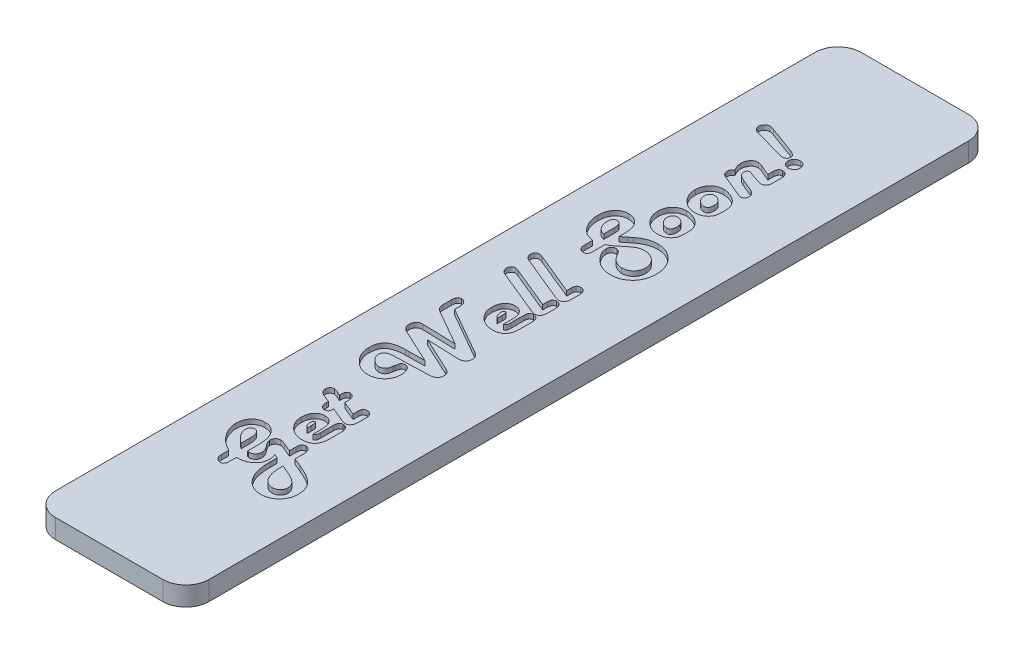
from build123d import *

# Parameters (mm, degrees)
BOSS_EXTRUDE1_DEPTH      = 66.675
BOSS_EXTRUDE1_DEPTH_BACK = 66.675
SKETCH3_W                = 25.4
SKETCH3_H                = 3.175
SKETCH5_OUTSIDE_W        = 54.556
SKETCH5_OUTSIDE_H        = 162.506
CUT_EXTRUDE2_DEPTH       = 68.947967225
CUT_EXTRUDE1_DEPTH       = 0.79375


with BuildPart() as part:
    # Sketch3 → Boss-Extrude1 (new, two sides: drawn at the far end of the back side and taken through both)
    with BuildSketch(Plane.XY.offset(-BOSS_EXTRUDE1_DEPTH_BACK)):
        Rectangle(SKETCH3_W, SKETCH3_H)
    extrude(amount=BOSS_EXTRUDE1_DEPTH + BOSS_EXTRUDE1_DEPTH_BACK)

    # Sketch5 outside → Cut-Extrude2 (cut, through all)
    with BuildSketch(Plane(origin=(0, 1.5875, 0), x_dir=(1, 0, 0), z_dir=(0, 1, 0))):
        Rectangle(SKETCH5_OUTSIDE_W, SKETCH5_OUTSIDE_H)
        with BuildLine():
            Line((12.7, -62.865), (12.7, 62.865))
            ThreePointArc((12.7, 62.865), (11.584076836, 65.559076836), (8.89, 66.675))
            Line((8.89, 66.675), (-8.89, 66.675))
            ThreePointArc((-8.89, 66.675), (-11.584076836, 65.559076836), (-12.7, 62.865))
            Line((-12.7, 62.865), (-12.7, -62.865))
            ThreePointArc((-12.7, -62.865), (-11.584076836, -65.559076836), (-8.89, -66.675))
            Line((-8.89, -66.675), (8.89, -66.675))
            ThreePointArc((8.89, -66.675), (11.584076836, -65.559076836), (12.7, -62.865))
        make_face(mode=Mode.SUBTRACT)
    extrude(amount=-CUT_EXTRUDE2_DEPTH, mode=Mode.SUBTRACT)

    # Sketch4 → Cut-Extrude1 (cut)
    # profile 1 of 13: a face of its own
    with BuildSketch(Plane(origin=(0, 1.5875, 0), x_dir=(1, 0, 0), z_dir=(0, 1, 0))):
        with BuildLine():
            Line((0.896164384, -37.735445205), (0.896164384, -36.667380137))
            add(Edge.make_bspline(
                [(0.896164384, -36.667380137), (0.8977978, -36.590159717), (0.900854424, -36.445656632), (0.933766313, -36.244632346), (0.981824908, -36.072089482), (1.058348571, -35.931904989), (1.154112041, -35.819901025), (1.274125634, -35.740840287), (1.415493222, -35.691674454), (1.517172017, -35.687248295), (1.570393836, -35.684931507)],
                knots=[0, 0, 0, 0, 1.369989722, 2.563670888, 3.609896329, 4.53422252, 5.378187446, 6.200567959, 7.058121745, 8, 8, 8, 8], degree=3))
            add(Edge.make_bspline(
                [(1.570393836, -35.684931507), (1.642317959, -35.68850553), (1.781690113, -35.695431152), (1.9775764, -35.764774279), (2.147611063, -35.877686865), (2.289961396, -36.033228246), (2.403588589, -36.226473586), (2.484418579, -36.454462242), (2.53054101, -36.716199279), (2.536725856, -36.901205139), (2.54, -36.999143836)],
                knots=[0, 0, 0, 0, 0.93648049, 1.814680487, 2.675302722, 3.578604075, 4.543849847, 5.584378058, 6.721214214, 8, 8, 8, 8], degree=3))
            Line((2.54, -36.999143836), (2.54, -38.443921233))
            Line((2.54, -38.443921233), (3.869195205, -38.981164384))
            add(Edge.make_bspline(
                [(3.869195205, -38.981164384), (4.046806812, -39.053101349), (4.390440499, -39.192281245), (4.878422764, -39.419636375), (5.329475197, -39.642049112), (5.738463125, -39.871282247), (6.107559757, -40.102012014), (6.437170527, -40.334614635), (6.723972933, -40.572341248), (6.97496886, -40.81177602), (7.190118164, -41.062325318), (7.377226207, -41.324119253), (7.531345403, -41.603943414), (7.661825779, -41.895239156), (7.758660059, -42.203895132), (7.833544724, -42.52547009), (7.87285146, -42.86361104), (7.879221435, -43.093520362), (7.882465753, -43.210616438)],
                knots=[0, 0, 0, 0, 1.469856145, 2.843801134, 4.128917198, 5.327234322, 6.438887973, 7.467126518, 8.419537668, 9.294379427, 10.124951455, 10.949586613, 11.758207913, 12.571834031, 13.394049645, 14.235907381, 15.101522626, 16, 16, 16, 16], degree=3))
            add(Edge.make_bspline(
                [(7.882465753, -43.210616438), (7.880495831, -43.320654654), (7.876616977, -43.537324199), (7.831105765, -43.855104298), (7.764205512, -44.160118682), (7.667312851, -44.450641003), (7.542352555, -44.726745047), (7.388979651, -44.988244585), (7.211479984, -45.238890971), (7.004109298, -45.469199324), (6.778835068, -45.681115852), (6.536635925, -45.865896298), (6.280124874, -46.02097594), (6.010166137, -46.147835595), (5.727469189, -46.249340495), (5.430289391, -46.319809761), (5.119618267, -46.360571951), (4.908128647, -46.36672507), (4.800273973, -46.369863014)],
                knots=[0, 0, 0, 0, 1.07010237, 2.107073371, 3.117768601, 4.105838678, 5.081584708, 6.061693756, 7.052078816, 8.065203891, 9.072291232, 10.058285401, 11.024024024, 11.983778443, 12.956679257, 13.941890775, 14.950413259, 16, 16, 16, 16], degree=3))
            add(Edge.make_bspline(
                [(4.800273973, -46.369863014), (4.714595357, -46.368129605), (4.545058278, -46.364699613), (4.294950796, -46.340117242), (4.051766066, -46.303679233), (3.818254451, -46.243224364), (3.589889746, -46.174190012), (3.370007323, -46.085593021), (3.15672836, -45.983376742), (2.953220328, -45.861958888), (2.755120652, -45.727128074), (2.565231562, -45.574988508), (2.382031679, -45.407057743), (2.207982308, -45.223060885), (2.038488439, -45.025394551), (1.881905967, -44.80814179), (1.728983137, -44.577204767), (1.635190147, -44.414759385), (1.587517123, -44.332191781)],
                knots=[0, 0, 0, 0, 1.024734478, 2.027699531, 3.00428115, 3.962680488, 4.910187485, 5.85634818, 6.795360648, 7.736542633, 8.688191925, 9.659875743, 10.644479921, 11.65863953, 12.688054805, 13.756667774, 14.85976096, 16, 16, 16, 16], degree=3))
            add(Edge.make_bspline(
                [(1.587517123, -44.332191781), (1.532677205, -44.224661459), (1.420125269, -44.003969191), (1.286580998, -43.646323253), (1.166748192, -43.262569075), (1.075517746, -42.848206232), (0.998845131, -42.406385732), (0.950287575, -41.934354233), (0.916643143, -41.433851446), (0.913010828, -41.090244083), (0.91114726, -40.913955479)],
                knots=[0, 0, 0, 0, 0.822675074, 1.688435649, 2.599691523, 3.562981745, 4.579801712, 5.656735202, 6.797782229, 8, 8, 8, 8], degree=3))
            Line((0.91114726, -40.913955479), (0.896164384, -39.758133562))
            Line((0.896164384, -39.758133562), (0.24119863, -39.514126712))
            add(Edge.make_bspline(
                [(0.24119863, -39.514126712), (0.27881072, -39.605476174), (0.353094684, -39.785891573), (0.42974736, -40.065870739), (0.476592836, -40.348716097), (0.482330918, -40.538491408), (0.485205479, -40.633561644)],
                knots=[0, 0, 0, 0, 1.026532818, 2.027404705, 3.011804546, 4, 4, 4, 4], degree=3))
            add(Edge.make_bspline(
                [(0.485205479, -40.633561644), (0.482762511, -40.72358012), (0.477969539, -40.900191476), (0.439636026, -41.158359243), (0.371775355, -41.401690823), (0.282223802, -41.633880995), (0.163523055, -41.851368997), (0.022039238, -42.057760667), (-0.150406514, -42.246078989), (-0.343027086, -42.423725591), (-0.560090847, -42.58018463), (-0.791196251, -42.72176432), (-1.041708751, -42.835507286), (-1.306171827, -42.934458202), (-1.589551732, -43.004650968), (-1.888230455, -43.058993157), (-2.203158569, -43.091263171), (-2.418545555, -43.095176857), (-2.528493151, -43.097174658)],
                knots=[0, 0, 0, 0, 0.988307793, 1.939006141, 2.857053538, 3.757650655, 4.665579203, 5.571883669, 6.498417049, 7.463406632, 8.444389255, 9.431982515, 10.434474024, 11.460628013, 12.528582364, 13.635098477, 14.792799688, 16, 16, 16, 16], degree=3))
            Line((-2.528493151, -43.097174658), (-2.528493151, -44.092465753))
            Line((-2.528493151, -44.092465753), (-2.528493151, -44.280821918))
            add(Edge.make_bspline(
                [(-2.528493151, -44.280821918), (-2.53046095, -44.348003748), (-2.53414712, -44.473851705), (-2.563175385, -44.650116821), (-2.613716838, -44.799781831), (-2.685148833, -44.924177865), (-2.779257686, -45.022174501), (-2.896969616, -45.088900346), (-3.032913124, -45.131307551), (-3.130321481, -45.135034894), (-3.181318493, -45.136986301)],
                knots=[0, 0, 0, 0, 1.313305689, 2.460141951, 3.47937397, 4.386228891, 5.244565032, 6.101198686, 7.005904658, 8, 8, 8, 8], degree=3))
            add(Edge.make_bspline(
                [(-3.181318493, -45.136986301), (-3.248953903, -45.133137248), (-3.381757693, -45.125579537), (-3.571555194, -45.057070213), (-3.74385207, -44.947493815), (-3.894499899, -44.797113215), (-4.017462516, -44.615664549), (-4.108742899, -44.411624375), (-4.163937476, -44.18667473), (-4.169470336, -44.030000535), (-4.172328767, -43.949058219)],
                knots=[0, 0, 0, 0, 0.940667582, 1.847023906, 2.777371326, 3.769526575, 4.793507983, 5.818021117, 6.872728065, 8, 8, 8, 8], degree=3))
            Line((-4.172328767, -43.949058219), (-4.172328767, -43.760702055))
            Line((-4.172328767, -43.760702055), (-4.172328767, -42.714041096))
            add(Edge.make_bspline(
                [(-4.172328767, -42.714041096), (-4.297975501, -42.647658091), (-4.545694307, -42.516780685), (-4.899137643, -42.298704078), (-5.234420074, -42.070879421), (-5.546086974, -41.826072202), (-5.838712517, -41.571417695), (-6.109676679, -41.30258736), (-6.359534701, -41.020578913), (-6.588205188, -40.727499868), (-6.795198359, -40.427584621), (-6.968508165, -40.117337081), (-7.124414436, -39.807384822), (-7.244059333, -39.489355083), (-7.343591727, -39.169877381), (-7.407116554, -38.84457165), (-7.454042367, -38.51662709), (-7.458010641, -38.295690547), (-7.46, -38.184931507)],
                knots=[0, 0, 0, 0, 1.158132186, 2.283315394, 3.383554422, 4.46091121, 5.511964361, 6.544247197, 7.570152985, 8.581195443, 9.573307306, 10.53710704, 11.476124637, 12.398550415, 13.30381888, 14.200376139, 15.097819632, 16, 16, 16, 16], degree=3))
            add(Edge.make_bspline(
                [(-7.46, -38.184931507), (-7.457612163, -38.094973674), (-7.452919862, -37.918198936), (-7.425948035, -37.659490157), (-7.376969345, -37.413502462), (-7.305167663, -37.182092822), (-7.217801311, -36.961249535), (-7.108717492, -36.753893086), (-6.979017902, -36.560007394), (-6.832008762, -36.380041842), (-6.667090722, -36.218810625), (-6.49236705, -36.073970927), (-6.303840475, -35.953150297), (-6.105104454, -35.854434362), (-5.893597681, -35.779106819), (-5.672310265, -35.723389131), (-5.438277281, -35.690806271), (-5.279022976, -35.686919217), (-5.197585616, -35.684931507)],
                knots=[0, 0, 0, 0, 1.141049445, 2.242258502, 3.294610142, 4.316486674, 5.311240396, 6.302902572, 7.281682775, 8.265344704, 9.244334024, 10.202527383, 11.138763911, 12.077620508, 13.010747116, 13.980788034, 14.967442098, 16, 16, 16, 16], degree=3))
            add(Edge.make_bspline(
                [(-5.197585616, -35.684931507), (-5.083816758, -35.688036622), (-4.860906033, -35.694120568), (-4.537379721, -35.759485226), (-4.232712681, -35.858900594), (-3.949198784, -36.001872956), (-3.687366539, -36.187193262), (-3.445405101, -36.411149176), (-3.221148711, -36.674468862), (-3.097398422, -36.874608274), (-3.033630137, -36.977739726)],
                knots=[0, 0, 0, 0, 1.028941457, 2.01603576, 2.976313307, 3.924054541, 4.879450914, 5.871691202, 6.903286584, 8, 8, 8, 8], degree=3))
            add(Edge.make_bspline(
                [(-3.033630137, -36.977739726), (-2.992892169, -37.053367649), (-2.908704586, -37.209657529), (-2.807557899, -37.467057261), (-2.719287037, -37.750114986), (-2.650555427, -38.061153335), (-2.594209035, -38.398254416), (-2.557394698, -38.762896302), (-2.533435232, -39.15421645), (-2.530174155, -39.424190992), (-2.528493151, -39.563356164)],
                knots=[0, 0, 0, 0, 0.773676733, 1.598851842, 2.487722916, 3.444033373, 4.467420569, 5.566768293, 6.745729481, 8, 8, 8, 8], degree=3))
            Line((-2.528493151, -39.563356164), (-2.528493151, -41.211472603))
            Line((-2.528493151, -41.211472603), (-2.344417808, -41.301369863))
            add(Edge.make_bspline(
                [(-2.344417808, -41.301369863), (-2.251343599, -41.298819444), (-2.076264147, -41.294021918), (-1.831478815, -41.23938377), (-1.621942015, -41.153087514), (-1.448183249, -41.028502031), (-1.316772565, -40.864125197), (-1.22380733, -40.665498384), (-1.168523206, -40.432443562), (-1.162049977, -40.265729833), (-1.158630137, -40.17765411)],
                knots=[0, 0, 0, 0, 1.191564126, 2.241420009, 3.196427466, 4.080247661, 4.951814165, 5.864335449, 6.87171739, 8, 8, 8, 8], degree=3))
            add(Edge.make_bspline(
                [(-1.158630137, -40.17765411), (-1.164171048, -40.093001837), (-1.175538542, -39.91933288), (-1.252165754, -39.659583213), (-1.379161343, -39.399089071), (-1.494318712, -39.235762142), (-1.554606164, -39.150256849)],
                knots=[0, 0, 0, 0, 0.907044843, 1.860854129, 2.880109388, 4, 4, 4, 4], degree=3))
            Line((-1.554606164, -39.150256849), (-1.858544521, -38.754280822))
            add(Edge.make_bspline(
                [(-1.858544521, -38.754280822), (-1.918209562, -38.672016253), (-2.028905001, -38.519392333), (-2.156466216, -38.288786098), (-2.235679015, -38.074382193), (-2.248544536, -37.935023133), (-2.254520548, -37.870291096)],
                knots=[0, 0, 0, 0, 1.238804421, 2.298330728, 3.209577627, 4, 4, 4, 4], degree=3))
            add(Edge.make_bspline(
                [(-2.254520548, -37.870291096), (-2.252272285, -37.804275426), (-2.247901836, -37.675946059), (-2.1956701, -37.493415447), (-2.116748093, -37.327277988), (-2.00424823, -37.183615247), (-1.867095222, -37.065179832), (-1.708650583, -36.977470256), (-1.529753314, -36.927277291), (-1.405092483, -36.921037885), (-1.340565068, -36.917808219)],
                knots=[0, 0, 0, 0, 1.068385501, 2.076858932, 3.055645015, 4.037713328, 5.01485416, 5.978731898, 6.953743506, 8, 8, 8, 8], degree=3))
            add(Edge.make_bspline(
                [(-1.340565068, -36.917808219), (-1.293253427, -36.920649317), (-1.18499219, -36.927150483), (-1.007692614, -36.976426798), (-0.793485886, -37.04343839), (-0.641657683, -37.104924259), (-0.559315068, -37.138270548)],
                knots=[0, 0, 0, 0, 0.695650793, 1.591828413, 2.693950539, 4, 4, 4, 4], degree=3))
            Line((-0.559315068, -37.138270548), (0.896164384, -37.735445205))
        make_face()
        with BuildLine():
            add(Edge.make_bspline(
                [(2.54, -40.460188356), (2.540494699, -40.58435508), (2.541456059, -40.82565133), (2.558238064, -41.176688776), (2.577764516, -41.505936889), (2.60927659, -41.81242256), (2.653376302, -42.095480552), (2.700593059, -42.356824743), (2.760271428, -42.595594964), (2.809550263, -42.744978921), (2.833236301, -42.816780822)],
                knots=[0, 0, 0, 0, 1.249240611, 2.427680006, 3.535585126, 4.567824485, 5.526277317, 6.417552364, 7.239391222, 8, 8, 8, 8], degree=3))
            add(Edge.make_bspline(
                [(2.833236301, -42.816780822), (2.879995391, -42.938113592), (2.970826228, -43.173805885), (3.156408929, -43.494227216), (3.36579349, -43.778347955), (3.604920468, -44.018436339), (3.866254694, -44.210338125), (4.143980353, -44.350943765), (4.437214263, -44.435526187), (4.637788027, -44.446540604), (4.738202055, -44.452054795)],
                knots=[0, 0, 0, 0, 1.164332211, 2.261747837, 3.308368124, 4.321669296, 5.287765916, 6.203291532, 7.100506819, 8, 8, 8, 8], degree=3))
            add(Edge.make_bspline(
                [(4.738202055, -44.452054795), (4.830007477, -44.44775363), (5.010058991, -44.439318058), (5.267563383, -44.366470365), (5.503626988, -44.248098619), (5.710448217, -44.083824774), (5.884119142, -43.886616743), (6.011784835, -43.661953197), (6.086795089, -43.41362888), (6.096618625, -43.241088193), (6.101643836, -43.152825342)],
                knots=[0, 0, 0, 0, 1.049206753, 2.057735391, 3.036562814, 4.054406259, 5.061611368, 6.026991024, 6.990711119, 8, 8, 8, 8], degree=3))
            add(Edge.make_bspline(
                [(6.101643836, -43.152825342), (6.100217206, -43.097766945), (6.097400409, -42.989057326), (6.068121123, -42.828031046), (6.020426705, -42.671985742), (5.95680913, -42.517807319), (5.86907812, -42.371426419), (5.768107374, -42.225219454), (5.646095096, -42.085368862), (5.504163613, -41.948994715), (5.343652237, -41.814021552), (5.159476109, -41.681283884), (4.954453928, -41.547144403), (4.72692554, -41.411017621), (4.474111109, -41.280154195), (4.199014777, -41.147395775), (3.902890051, -41.012078122), (3.69542996, -40.927473895), (3.58880137, -40.883989726)],
                knots=[0, 0, 0, 0, 0.736209836, 1.453603702, 2.181594429, 2.917556549, 3.679088946, 4.460533659, 5.293208217, 6.157526432, 7.09277175, 8.097340998, 9.193732733, 10.371118816, 11.643874246, 13.001881714, 14.459052414, 16, 16, 16, 16], degree=3))
            Line((3.58880137, -40.883989726), (2.54, -40.460188356))
        make_face(mode=Mode.SUBTRACT)
        with BuildLine():
            Line((-4.172328767, -40.682791096), (-4.172328767, -39.282962329))
            add(Edge.make_bspline(
                [(-4.172328767, -39.282962329), (-4.173305656, -39.209465417), (-4.175194107, -39.067386609), (-4.185277281, -38.86093342), (-4.204650494, -38.669588928), (-4.230134176, -38.491590902), (-4.263056714, -38.328199683), (-4.306929932, -38.179173156), (-4.355395961, -38.043349361), (-4.412295015, -37.921875949), (-4.478188351, -37.814664757), (-4.549207294, -37.720631284), (-4.630496897, -37.641930838), (-4.718064739, -37.577215253), (-4.814326426, -37.5273584), (-4.91781132, -37.490499496), (-5.029732249, -37.468838628), (-5.106881149, -37.466795248), (-5.146215753, -37.465753425)],
                knots=[0, 0, 0, 0, 1.530198726, 2.958067312, 4.301549615, 5.532509491, 6.700659471, 7.767736285, 8.763917801, 9.700748564, 10.554146358, 11.380086353, 12.146877977, 12.901488325, 13.638946197, 14.395308738, 15.181843204, 16, 16, 16, 16], degree=3))
            add(Edge.make_bspline(
                [(-5.146215753, -37.465753425), (-5.192287069, -37.468477385), (-5.283173256, -37.473851018), (-5.411973089, -37.521536137), (-5.529607594, -37.596611795), (-5.630185648, -37.70181237), (-5.713496618, -37.828016816), (-5.774959956, -37.972054356), (-5.808218509, -38.132779985), (-5.813454458, -38.244718852), (-5.816164384, -38.30265411)],
                knots=[0, 0, 0, 0, 0.923168271, 1.821160125, 2.724061258, 3.707615728, 4.721738292, 5.749754973, 6.835359619, 8, 8, 8, 8], degree=3))
            add(Edge.make_bspline(
                [(-5.816164384, -38.30265411), (-5.810266714, -38.398057802), (-5.798052001, -38.59564918), (-5.71104161, -38.894138505), (-5.571023999, -39.200628074), (-5.377710762, -39.511648722), (-5.139439424, -39.823271076), (-4.853117898, -40.121653961), (-4.533069677, -40.415452121), (-4.294629449, -40.592156133), (-4.172328767, -40.682791096)],
                knots=[0, 0, 0, 0, 0.765257907, 1.584931981, 2.476874392, 3.463915938, 4.5176594, 5.619536316, 6.77901337, 8, 8, 8, 8], degree=3))
        make_face(mode=Mode.SUBTRACT)
    # profile 2 of 13: a face of its own
    with BuildSketch(Plane(origin=(0, 1.5875, 0), x_dir=(1, 0, 0), z_dir=(0, 1, 0))):
        with BuildLine():
            add(Edge.make_bspline(
                [(0.485205479, -33.409674658), (0.517756621, -33.407440454), (0.581105968, -33.403092362), (0.66882459, -33.36155629), (0.741661321, -33.294039391), (0.798876586, -33.201144791), (0.843990289, -33.08444339), (0.874049625, -32.942909852), (0.893306161, -32.775927737), (0.89516532, -32.656314631), (0.896164384, -32.592037671)],
                knots=[0, 0, 0, 0, 0.764367135, 1.48757176, 2.238468815, 3.079136104, 4.038989023, 5.178564659, 6.483834326, 8, 8, 8, 8], degree=3))
            Line((0.896164384, -32.592037671), (0.896164384, -30.44734589))
            add(Edge.make_bspline(
                [(0.896164384, -30.44734589), (0.897845932, -30.375117705), (0.901011907, -30.23912843), (0.933836463, -30.049414832), (0.982265841, -29.885483436), (1.058305916, -29.751930793), (1.155156215, -29.64665628), (1.273984409, -29.572219413), (1.414737085, -29.528139202), (1.515119833, -29.523175357), (1.568253425, -29.520547945)],
                knots=[0, 0, 0, 0, 1.330378268, 2.504800222, 3.540784378, 4.466013521, 5.313015675, 6.152526175, 7.022113639, 8, 8, 8, 8], degree=3))
            add(Edge.make_bspline(
                [(1.568253425, -29.520547945), (1.64083197, -29.523543024), (1.781090853, -29.52933105), (1.97744335, -29.593840977), (2.149429434, -29.697388291), (2.291101807, -29.844566382), (2.405391827, -30.025763608), (2.483928318, -30.242493793), (2.533665817, -30.489308855), (2.537821652, -30.665402926), (2.54, -30.757705479)],
                knots=[0, 0, 0, 0, 0.976459769, 1.88701984, 2.755728993, 3.661387505, 4.617841531, 5.626579212, 6.755933135, 8, 8, 8, 8], degree=3))
            Line((2.54, -30.757705479), (2.54, -32.801797945))
            add(Edge.make_bspline(
                [(2.54, -32.801797945), (2.538498971, -32.894617254), (2.53559464, -33.074212668), (2.509171856, -33.335289781), (2.467638756, -33.578901582), (2.406991582, -33.805823013), (2.331071401, -34.016786427), (2.234367496, -34.209329914), (2.121707372, -34.385053479), (1.993935794, -34.544523384), (1.846468801, -34.68367772), (1.68632924, -34.807217656), (1.50762556, -34.908122677), (1.313832731, -34.991767291), (1.104412336, -35.057720126), (0.879361474, -35.104814839), (0.63861038, -35.132930757), (0.472441412, -35.135606432), (0.386746575, -35.136986301)],
                knots=[0, 0, 0, 0, 1.227434829, 2.374954843, 3.467242871, 4.492791281, 5.478078509, 6.427692534, 7.336082474, 8.235159391, 9.122921699, 10.011937165, 10.903903105, 11.829580614, 12.799608803, 13.802811811, 14.866890212, 16, 16, 16, 16], degree=3))
            add(Edge.make_bspline(
                [(0.386746575, -35.136986301), (0.27529072, -35.134205542), (0.055729393, -35.128727612), (-0.267626242, -35.082327734), (-0.578471097, -35.007288102), (-0.879544621, -34.904251144), (-1.167326721, -34.769034173), (-1.444743769, -34.605117902), (-1.707437797, -34.40853284), (-1.958138807, -34.188243987), (-2.187995288, -33.947070778), (-2.386869774, -33.689079105), (-2.558330015, -33.422037683), (-2.698722771, -33.142657153), (-2.805102894, -32.850577111), (-2.882747934, -32.548163312), (-2.931632929, -32.234756456), (-2.936825326, -32.021439933), (-2.939452055, -31.913527397)],
                knots=[0, 0, 0, 0, 1.040413245, 2.049551489, 3.043375534, 4.023141954, 5.015714557, 6.007526584, 7.026927923, 8.074887039, 9.121150428, 10.132661257, 11.112246432, 12.080619832, 13.046032014, 14.009142413, 14.992865218, 16, 16, 16, 16], degree=3))
            add(Edge.make_bspline(
                [(-2.939452055, -31.913527397), (-2.937442252, -31.835728851), (-2.93350729, -31.683408304), (-2.913500509, -31.460528901), (-2.87365921, -31.250604506), (-2.823588014, -31.05150982), (-2.754315656, -30.864791712), (-2.67077078, -30.689598655), (-2.574876712, -30.524586085), (-2.460203657, -30.375430084), (-2.335762022, -30.238959565), (-2.199287464, -30.11986792), (-2.053853946, -30.018682097), (-1.898107029, -29.937358651), (-1.734296616, -29.871566801), (-1.55926394, -29.827822492), (-1.375083247, -29.798596357), (-1.248645155, -29.795894976), (-1.184315068, -29.794520548)],
                knots=[0, 0, 0, 0, 1.20765167, 2.364442186, 3.467641136, 4.520347312, 5.546697016, 6.552049339, 7.529957554, 8.502082256, 9.465848252, 10.391794486, 11.307021153, 12.208414204, 13.113065312, 14.039540961, 15.002543477, 16, 16, 16, 16], degree=3))
            add(Edge.make_bspline(
                [(-1.184315068, -29.794520548), (-1.107819997, -29.796911844), (-0.958096616, -29.801592315), (-0.741213008, -29.84028638), (-0.540220667, -29.905559744), (-0.353170282, -29.992416088), (-0.184652246, -30.111340893), (-0.030384031, -30.252680123), (0.10960169, -30.41992511), (0.185136878, -30.546769253), (0.224075342, -30.612157534)],
                knots=[0, 0, 0, 0, 1.069075517, 2.092495602, 3.067309766, 4.01772645, 4.964103366, 5.938458037, 6.93727308, 8, 8, 8, 8], degree=3))
            add(Edge.make_bspline(
                [(0.224075342, -30.612157534), (0.245815438, -30.651626885), (0.290796308, -30.733290082), (0.33971322, -30.869765309), (0.385182547, -31.018192666), (0.424024217, -31.180218957), (0.451113845, -31.357101146), (0.469332866, -31.547232305), (0.483154329, -31.751372378), (0.484506156, -31.892097629), (0.485205479, -31.96489726)],
                knots=[0, 0, 0, 0, 0.775695059, 1.604934926, 2.492087677, 3.452766344, 4.473981776, 5.574285297, 6.74513539, 8, 8, 8, 8], degree=3))
            Line((0.485205479, -31.96489726), (0.485205479, -33.409674658))
        make_face()
        with BuildLine():
            Line((-0.884657534, -33.062928082), (-0.884657534, -32.266695205))
            add(Edge.make_bspline(
                [(-0.884657534, -32.266695205), (-0.885670373, -32.200345862), (-0.887555968, -32.076823668), (-0.896204511, -31.904228206), (-0.917855063, -31.759922564), (-0.943812843, -31.641299959), (-0.980392519, -31.550599068), (-1.020588456, -31.481030321), (-1.079199118, -31.441749963), (-1.121074096, -31.439469103), (-1.141506849, -31.438356164)],
                knots=[0, 0, 0, 0, 1.703756022, 3.171872855, 4.430737384, 5.448043455, 6.277929624, 6.938312386, 7.48195314, 8, 8, 8, 8], degree=3))
            add(Edge.make_bspline(
                [(-1.141506849, -31.438356164), (-1.164680225, -31.441343401), (-1.209182799, -31.447080144), (-1.270664555, -31.477355109), (-1.321852732, -31.522714348), (-1.363341756, -31.583212735), (-1.395800383, -31.65712203), (-1.415025871, -31.746587902), (-1.431455001, -31.849439625), (-1.43220441, -31.923429384), (-1.43260274, -31.962756849)],
                knots=[0, 0, 0, 0, 0.839283018, 1.611774451, 2.433858042, 3.284934843, 4.2429058, 5.330802008, 6.5812524, 8, 8, 8, 8], degree=3))
            add(Edge.make_bspline(
                [(-1.43260274, -31.962756849), (-1.431043071, -32.019227629), (-1.427985788, -32.129922337), (-1.40145814, -32.291463153), (-1.359424558, -32.44415636), (-1.297730616, -32.58731619), (-1.222213662, -32.722459878), (-1.124704301, -32.845523044), (-1.014611987, -32.962441107), (-0.92844664, -33.029068259), (-0.884657534, -33.062928082)],
                knots=[0, 0, 0, 0, 1.059074119, 2.076009944, 3.063613489, 4.023510937, 4.995010178, 5.959100355, 6.962817714, 8, 8, 8, 8], degree=3))
        make_face(mode=Mode.SUBTRACT)
    # profile 3 of 13: a face of its own
    with BuildSketch(Plane(origin=(0, 1.5875, 0), x_dir=(1, 0, 0), z_dir=(0, 1, 0))):
        with BuildLine():
            Line((-2.939452055, -25.639982877), (-2.939452055, -25.417380137))
            add(Edge.make_bspline(
                [(-2.939452055, -25.417380137), (-2.938597618, -25.341584932), (-2.937001552, -25.200001535), (-2.905261991, -25.002977816), (-2.862197077, -24.83355162), (-2.791559903, -24.695727286), (-2.706465145, -24.583982588), (-2.596146667, -24.505756222), (-2.466312089, -24.459780445), (-2.373336577, -24.454691846), (-2.32515411, -24.452054795)],
                knots=[0, 0, 0, 0, 1.404766941, 2.624066756, 3.697329339, 4.633101669, 5.481073342, 6.278523074, 7.107883314, 8, 8, 8, 8], degree=3))
            add(Edge.make_bspline(
                [(-2.32515411, -24.452054795), (-2.25828012, -24.455967929), (-2.12922158, -24.463519794), (-1.946143586, -24.528214007), (-1.788903158, -24.638353427), (-1.65938028, -24.790541935), (-1.557144304, -24.97729955), (-1.481905811, -25.196344157), (-1.440796503, -25.447959142), (-1.435430827, -25.625566543), (-1.43260274, -25.719178082)],
                knots=[0, 0, 0, 0, 0.919398437, 1.774325409, 2.635950289, 3.534730837, 4.502808992, 5.553491888, 6.710518879, 8, 8, 8, 8], degree=3))
            Line((-1.43260274, -25.719178082), (-1.43260274, -26.247859589))
            Line((-1.43260274, -26.247859589), (0.896164384, -27.215325342))
            Line((0.896164384, -27.215325342), (0.896164384, -26.40625))
            add(Edge.make_bspline(
                [(0.896164384, -26.40625), (0.897820458, -26.339003037), (0.90092579, -26.212907189), (0.933820976, -26.037317965), (0.983100855, -25.885578463), (1.059056019, -25.761483476), (1.155529638, -25.662594716), (1.275473608, -25.59603723), (1.4148413, -25.553218285), (1.515101919, -25.549772128), (1.568253425, -25.547945205)],
                knots=[0, 0, 0, 0, 1.296173651, 2.430475782, 3.436411947, 4.357433536, 5.214253337, 6.071626175, 6.977704557, 8, 8, 8, 8], degree=3))
            add(Edge.make_bspline(
                [(1.568253425, -25.547945205), (1.640750368, -25.551289118), (1.780426794, -25.557731676), (1.976442728, -25.616924135), (2.148376596, -25.713525702), (2.290285842, -25.851780844), (2.404819388, -26.022139557), (2.483802136, -26.226061999), (2.533615199, -26.458063731), (2.537806705, -26.623578978), (2.54, -26.710188356)],
                knots=[0, 0, 0, 0, 1.012475122, 1.950687848, 2.836200814, 3.747241311, 4.697123732, 5.687245437, 6.789801922, 8, 8, 8, 8], degree=3))
            Line((2.54, -26.710188356), (2.54, -28.002996575))
            add(Edge.make_bspline(
                [(2.54, -28.002996575), (2.537909143, -28.09389787), (2.533922648, -28.267213132), (2.482597407, -28.512168753), (2.405630116, -28.729361475), (2.293605658, -28.91400339), (2.153473989, -29.061863308), (1.988731169, -29.171010263), (1.798876745, -29.234811112), (1.665050463, -29.242574322), (1.596078767, -29.246575342)],
                knots=[0, 0, 0, 0, 1.24133797, 2.366773933, 3.40738576, 4.379865091, 5.29793282, 6.172266488, 7.05801852, 8, 8, 8, 8], degree=3))
            add(Edge.make_bspline(
                [(1.596078767, -29.246575342), (1.549579011, -29.244899447), (1.454477978, -29.241471915), (1.308452847, -29.213046014), (1.155429571, -29.171573125), (1.053476826, -29.130640098), (1.001044521, -29.109589041)],
                knots=[0, 0, 0, 0, 0.907525037, 1.856064993, 2.897416102, 4, 4, 4, 4], degree=3))
            Line((1.001044521, -29.109589041), (0.679982877, -28.966181507))
            Line((0.679982877, -28.966181507), (-1.43260274, -28.075770548))
            Line((-1.43260274, -28.075770548), (-1.43260274, -28.182791096))
            add(Edge.make_bspline(
                [(-1.43260274, -28.182791096), (-1.433589229, -28.244306864), (-1.435449943, -28.360337823), (-1.466323563, -28.522346016), (-1.512115912, -28.660863363), (-1.57602653, -28.777410754), (-1.664985978, -28.86474002), (-1.770690668, -28.929457513), (-1.896955972, -28.965715378), (-1.98674124, -28.970225761), (-2.034058219, -28.97260274)],
                knots=[0, 0, 0, 0, 1.303205949, 2.458105329, 3.482525421, 4.391261434, 5.247550381, 6.096448699, 6.99682543, 8, 8, 8, 8], degree=3))
            add(Edge.make_bspline(
                [(-2.034058219, -28.97260274), (-2.101605785, -28.969366622), (-2.232490475, -28.963096105), (-2.416538568, -28.901269067), (-2.575828297, -28.798943021), (-2.71019804, -28.659343093), (-2.81637551, -28.482463975), (-2.885891188, -28.271786563), (-2.932658029, -28.032149708), (-2.937099076, -27.861988124), (-2.939452055, -27.771832192)],
                knots=[0, 0, 0, 0, 0.952447723, 1.845526556, 2.707300174, 3.606056615, 4.560904597, 5.597636624, 6.727166828, 8, 8, 8, 8], degree=3))
            Line((-2.939452055, -27.771832192), (-2.939452055, -27.440068493))
            Line((-2.939452055, -27.440068493), (-3.941164384, -27.048373288))
            Line((-3.941164384, -27.048373288), (-4.146643836, -26.967037671))
            add(Edge.make_bspline(
                [(-4.146643836, -26.967037671), (-4.213930243, -26.938180374), (-4.343170608, -26.882752721), (-4.514919928, -26.773566667), (-4.66321386, -26.656016619), (-4.784279329, -26.524908489), (-4.879273612, -26.380537375), (-4.944863903, -26.222893638), (-4.98807233, -26.053229762), (-4.992155946, -25.935632602), (-4.994246575, -25.875428082)],
                knots=[0, 0, 0, 0, 1.188557093, 2.282921014, 3.297460827, 4.258041487, 5.171813088, 6.09182211, 7.023097711, 8, 8, 8, 8], degree=3))
            add(Edge.make_bspline(
                [(-4.994246575, -25.875428082), (-4.992071872, -25.826586727), (-4.987770361, -25.729979682), (-4.944713961, -25.592318427), (-4.879917077, -25.464043033), (-4.786923001, -25.352336854), (-4.678441409, -25.25699039), (-4.555277887, -25.185694861), (-4.419767348, -25.143527107), (-4.325305665, -25.139193056), (-4.277208904, -25.136986301)],
                knots=[0, 0, 0, 0, 1.02277323, 2.023021274, 3.001372947, 4.023926674, 5.054244114, 6.020591017, 6.992150498, 8, 8, 8, 8], degree=3))
            add(Edge.make_bspline(
                [(-4.277208904, -25.136986301), (-4.225667148, -25.13989504), (-4.114235034, -25.146183667), (-3.938775547, -25.187269341), (-3.745732326, -25.255424067), (-3.613298925, -25.313695397), (-3.543047945, -25.344606164)],
                knots=[0, 0, 0, 0, 0.80516182, 1.74074169, 2.801547737, 4, 4, 4, 4], degree=3))
            Line((-3.543047945, -25.344606164), (-2.939452055, -25.639982877))
        make_face()
    # profile 4 of 13: a face of its own
    with BuildSketch(Plane(origin=(0, 1.5875, 0), x_dir=(1, 0, 0), z_dir=(0, 1, 0))):
        with BuildLine():
            Line((-5.679178082, -3.812071918), (2.086232877, -8.261986301))
            add(Edge.make_bspline(
                [(2.086232877, -8.261986301), (2.154895066, -8.303473983), (2.286747748, -8.383143189), (2.462475755, -8.518840862), (2.613197367, -8.658695854), (2.736330368, -8.806456472), (2.831772321, -8.962455675), (2.90152275, -9.124254407), (2.944166787, -9.293616144), (2.948686086, -9.409006349), (2.950958904, -9.467037671)],
                knots=[0, 0, 0, 0, 1.235610167, 2.372754427, 3.415189433, 4.399386436, 5.327296268, 6.223989613, 7.106819934, 8, 8, 8, 8], degree=3))
            add(Edge.make_bspline(
                [(2.950958904, -9.467037671), (2.947234915, -9.55235765), (2.940105569, -9.715697449), (2.87511019, -9.946889817), (2.762992825, -10.145855108), (2.610898287, -10.314950915), (2.41501277, -10.444166352), (2.182734229, -10.536324137), (1.91467234, -10.591328565), (1.724061582, -10.597967182), (1.62390411, -10.601455479)],
                knots=[0, 0, 0, 0, 1.032022901, 1.975743725, 2.877249899, 3.776558033, 4.704155241, 5.692711085, 6.78762234, 8, 8, 8, 8], degree=3))
            Line((1.62390411, -10.601455479), (-3.547328767, -10.413099315))
            Line((-3.547328767, -10.413099315), (2.094794521, -13.043664384))
            add(Edge.make_bspline(
                [(2.094794521, -13.043664384), (2.162677866, -13.077142366), (2.292902173, -13.141364996), (2.468604054, -13.258185055), (2.616750913, -13.386330392), (2.739690619, -13.525264025), (2.835282909, -13.676045318), (2.901645747, -13.839253952), (2.944589954, -14.012490112), (2.948810828, -14.132161975), (2.950958904, -14.193065068)],
                knots=[0, 0, 0, 0, 1.192562719, 2.287757786, 3.316449283, 4.273170151, 5.203328878, 6.11632073, 7.041362847, 8, 8, 8, 8], degree=3))
            add(Edge.make_bspline(
                [(2.950958904, -14.193065068), (2.947438491, -14.279149812), (2.940689316, -14.444187567), (2.87275443, -14.677246984), (2.758379695, -14.879496102), (2.60182239, -15.050553817), (2.406423538, -15.187634105), (2.173938305, -15.280201442), (1.910137409, -15.339831074), (1.722725505, -15.345760453), (1.62390411, -15.348886986)],
                knots=[0, 0, 0, 0, 1.035479988, 1.985175139, 2.893927205, 3.813075981, 4.757774756, 5.744698437, 6.810790334, 8, 8, 8, 8], degree=3))
            Line((1.62390411, -15.348886986), (-3.348270548, -15.498715753))
            add(Edge.make_bspline(
                [(-3.348270548, -15.498715753), (-3.451716371, -15.500005384), (-3.650080857, -15.50247834), (-3.934404493, -15.508191652), (-4.191782465, -15.529877106), (-4.42361756, -15.550644575), (-4.628100582, -15.584334698), (-4.808179838, -15.617483907), (-4.95964052, -15.666199205), (-5.090011014, -15.715770593), (-5.198206493, -15.780592688), (-5.292305077, -15.855395211), (-5.368979764, -15.946498621), (-5.432828396, -16.049496992), (-5.480830969, -16.16546086), (-5.518242079, -16.293690893), (-5.53924692, -16.435522934), (-5.541185447, -16.534607451), (-5.542191781, -16.586044521)],
                knots=[0, 0, 0, 0, 1.77289446, 3.399647166, 4.870851003, 6.198057093, 7.385964447, 8.421762999, 9.330503142, 10.109213724, 10.805327258, 11.483164621, 12.159456676, 12.834642775, 13.552219238, 14.30288092, 15.118986154, 16, 16, 16, 16], degree=3))
            add(Edge.make_bspline(
                [(-5.542191781, -16.586044521), (-5.540778178, -16.634005825), (-5.537947839, -16.730034777), (-5.507266894, -16.873328853), (-5.463633241, -17.016903358), (-5.397137345, -17.159746095), (-5.314115351, -17.302395651), (-5.212050461, -17.44408542), (-5.093945047, -17.586334858), (-4.95881488, -17.723636699), (-4.817246795, -17.855657872), (-4.668041, -17.967463657), (-4.523290354, -18.068886462), (-4.3745152, -18.147205497), (-4.226900901, -18.211153513), (-4.076927602, -18.25293326), (-3.928108218, -18.283193069), (-3.827869271, -18.286193344), (-3.778493151, -18.287671233)],
                knots=[0, 0, 0, 0, 0.866115021, 1.734150476, 2.640199366, 3.575725343, 4.576106284, 5.621658045, 6.730285873, 7.91662244, 9.104081369, 10.226813399, 11.286208893, 12.296527636, 13.262355488, 14.189388292, 15.108121297, 16, 16, 16, 16], degree=3))
            add(Edge.make_bspline(
                [(-3.778493151, -18.287671233), (-3.698867024, -18.284482672), (-3.54499035, -18.278320812), (-3.327170735, -18.21638785), (-3.132982863, -18.116374942), (-2.968191037, -17.975118483), (-2.831689094, -17.803650491), (-2.734866265, -17.602510336), (-2.6751683, -17.37710822), (-2.668794042, -17.218569613), (-2.665479452, -17.136130137)],
                knots=[0, 0, 0, 0, 1.058909386, 2.046331556, 2.990504153, 3.948649762, 4.916886086, 5.890708973, 6.903176634, 8, 8, 8, 8], degree=3))
            add(Edge.make_bspline(
                [(-2.665479452, -17.136130137), (-2.662484194, -17.08697602), (-2.656513871, -16.988999183), (-2.618212582, -16.898628431), (-2.599126712, -16.85359589)],
                knots=[0, 0, 0, 0, 1.003382407, 2, 2, 2, 2], degree=3))
            add(Edge.make_bspline(
                [(-2.599126712, -16.85359589), (-2.579074031, -16.818060834), (-2.548740283, -16.764306851), (-2.533618426, -16.704704535), (-2.528493151, -16.684503425)],
                knots=[0, 0, 0, 0, 1.322136717, 2, 2, 2, 2], degree=3))
            add(Edge.make_bspline(
                [(-2.528493151, -16.684503425), (-2.5266693, -16.617301312), (-2.523230313, -16.490587449), (-2.491924693, -16.312623674), (-2.437677397, -16.160744689), (-2.358671867, -16.036175481), (-2.257456194, -15.938949865), (-2.134143033, -15.869000979), (-1.988139285, -15.827508875), (-1.883804201, -15.82385293), (-1.828578767, -15.821917808)],
                knots=[0, 0, 0, 0, 1.270335073, 2.395297653, 3.403013999, 4.30142859, 5.160465133, 6.03087456, 6.957725423, 8, 8, 8, 8], degree=3))
            add(Edge.make_bspline(
                [(-1.828578767, -15.821917808), (-1.790643325, -15.823690677), (-1.715470429, -15.827203796), (-1.60583691, -15.8513597), (-1.500440649, -15.890675303), (-1.400520843, -15.946600803), (-1.30464443, -16.017761015), (-1.21747928, -16.108052082), (-1.131316241, -16.209876767), (-1.024819584, -16.370505525), (-0.91155337, -16.598500293), (-0.815700171, -16.904644782), (-0.757604407, -17.243091813), (-0.751067277, -17.479780022), (-0.747671233, -17.602739726)],
                knots=[0, 0, 0, 0, 0.594709649, 1.178477022, 1.752076093, 2.35306806, 2.968469414, 3.617245171, 4.316363459, 5.0580592, 6.634295446, 8.290360146, 10.072839282, 12, 12, 12, 12], degree=3))
            add(Edge.make_bspline(
                [(-0.747671233, -17.602739726), (-0.750203248, -17.699884243), (-0.755155364, -17.889879555), (-0.792143142, -18.168840067), (-0.854022722, -18.434002005), (-0.940034966, -18.68750814), (-1.052160567, -18.927306794), (-1.186532947, -19.156019231), (-1.349952413, -19.368404322), (-1.531950546, -19.568980435), (-1.734878105, -19.749519419), (-1.95147913, -19.910128615), (-2.183902816, -20.041893001), (-2.427816144, -20.152708941), (-2.684621378, -20.238192141), (-2.955083311, -20.29782281), (-3.238078032, -20.334972552), (-3.431630713, -20.339937266), (-3.530205479, -20.342465753)],
                knots=[0, 0, 0, 0, 1.066324536, 2.085518248, 3.08301965, 4.051560175, 5.018801177, 5.984677386, 6.957547629, 7.955510247, 8.954026042, 9.934779246, 10.910231806, 11.88133457, 12.872139703, 13.875528653, 14.918024463, 16, 16, 16, 16], degree=3))
            add(Edge.make_bspline(
                [(-3.530205479, -20.342465753), (-3.651010678, -20.338809744), (-3.891161346, -20.331541902), (-4.246581566, -20.271590306), (-4.592049298, -20.174697455), (-4.929085803, -20.042156022), (-5.252861215, -19.865637234), (-5.570137728, -19.655277153), (-5.875147356, -19.403157885), (-6.167787123, -19.119498756), (-6.4355124, -18.810996363), (-6.673877168, -18.488709426), (-6.873133571, -18.154192894), (-7.036161962, -17.809873919), (-7.167372963, -17.45752698), (-7.255361349, -17.093100079), (-7.314655827, -16.71926983), (-7.320210811, -16.465700661), (-7.323013699, -16.337756849)],
                knots=[0, 0, 0, 0, 0.953875584, 1.896225167, 2.838439898, 3.784591124, 4.750381514, 5.746148718, 6.787528398, 7.871682268, 8.962336226, 10.01073888, 11.034381374, 12.032745232, 13.017009008, 13.998509376, 14.990104587, 16, 16, 16, 16], degree=3))
            add(Edge.make_bspline(
                [(-7.323013699, -16.337756849), (-7.3204319, -16.223521007), (-7.315431902, -16.002288069), (-7.280407271, -15.682310232), (-7.21552692, -15.387222281), (-7.127922829, -15.116002946), (-7.017871551, -14.866952755), (-6.877147257, -14.645470624), (-6.712909313, -14.44768522), (-6.521620448, -14.274675474), (-6.303061651, -14.123286343), (-6.053653706, -13.995955543), (-5.776960957, -13.883921856), (-5.469143886, -13.794933656), (-5.131746845, -13.727585211), (-4.764235869, -13.679029915), (-4.366885552, -13.649122906), (-4.091760915, -13.645071181), (-3.949726027, -13.642979452)],
                knots=[0, 0, 0, 0, 1.10071077, 2.131673136, 3.09581119, 4.00671651, 4.874362054, 5.711654594, 6.526723652, 7.344311087, 8.189105315, 9.080819389, 10.036983528, 11.061577255, 12.163082057, 13.34922629, 14.631520796, 16, 16, 16, 16], degree=3))
            Line((-3.949726027, -13.642979452), (-3.373955479, -13.636558219))
            Line((-3.373955479, -13.636558219), (-0.833287671, -13.591609589))
            Line((-0.833287671, -13.591609589), (-6.372671233, -11.012414384))
            add(Edge.make_bspline(
                [(-6.372671233, -11.012414384), (-6.447942826, -10.975763501), (-6.593052342, -10.905107471), (-6.786393572, -10.772153161), (-6.954378641, -10.630096202), (-7.088526641, -10.468363701), (-7.195619405, -10.294695743), (-7.268100021, -10.104268117), (-7.315038149, -9.901681341), (-7.320320003, -9.761256004), (-7.323013699, -9.689640411)],
                knots=[0, 0, 0, 0, 1.158578803, 2.23352268, 3.242661371, 4.197140942, 5.133109266, 6.056618834, 7.008894002, 8, 8, 8, 8], degree=3))
            add(Edge.make_bspline(
                [(-7.323013699, -9.689640411), (-7.319539998, -9.608653849), (-7.312870381, -9.453157048), (-7.255606612, -9.232276648), (-7.163103401, -9.035876203), (-7.033424808, -8.866876545), (-6.870936598, -8.730843368), (-6.681738401, -8.630521585), (-6.466724453, -8.571653006), (-6.315963413, -8.565060613), (-6.237825342, -8.561643836)],
                knots=[0, 0, 0, 0, 1.101649376, 2.115202212, 3.084554287, 4.040909478, 4.992810265, 5.949214832, 6.937096767, 8, 8, 8, 8], degree=3))
            Line((-6.237825342, -8.561643836), (-6.158630137, -8.568065068))
            Line((-6.158630137, -8.568065068), (-0.71984589, -8.702910959))
            Line((-0.71984589, -8.702910959), (-6.394075342, -5.451626712))
            Line((-6.394075342, -5.451626712), (-6.661626712, -5.299657534))
            add(Edge.make_bspline(
                [(-6.661626712, -5.299657534), (-6.713988562, -5.266057359), (-6.817028384, -5.19993754), (-6.952098948, -5.079032934), (-7.066787405, -4.944816463), (-7.162090071, -4.798460439), (-7.23581945, -4.637728934), (-7.286670639, -4.463208964), (-7.316750937, -4.27543948), (-7.320887956, -4.14608835), (-7.323013699, -4.079623288)],
                knots=[0, 0, 0, 0, 1.022934504, 2.012972987, 2.971002299, 3.922312064, 4.878828185, 5.871093666, 6.906094656, 8, 8, 8, 8], degree=3))
            Line((-7.323013699, -4.079623288), (-7.323013699, -2.669092466))
            add(Edge.make_bspline(
                [(-7.323013699, -2.669092466), (-7.321308972, -2.594026184), (-7.318108572, -2.453099184), (-7.285967454, -2.257512934), (-7.236411973, -2.089715768), (-7.160875406, -1.952701), (-7.064897175, -1.842891429), (-6.944821168, -1.765892066), (-6.803292741, -1.719642828), (-6.701949596, -1.714845487), (-6.648784247, -1.712328767)],
                knots=[0, 0, 0, 0, 1.35416815, 2.542271294, 3.568978713, 4.497394312, 5.345766, 6.174746035, 7.042458518, 8, 8, 8, 8], degree=3))
            add(Edge.make_bspline(
                [(-6.648784247, -1.712328767), (-6.576913983, -1.716092776), (-6.437878032, -1.723374404), (-6.241834346, -1.789809423), (-6.071630639, -1.900637073), (-5.9299208, -2.053761681), (-5.815514949, -2.242899174), (-5.734433273, -2.46744822), (-5.688941983, -2.725060583), (-5.6825432, -2.907206232), (-5.679178082, -3.002996575)],
                knots=[0, 0, 0, 0, 0.946594095, 1.831224812, 2.695975928, 3.602156563, 4.561689612, 5.595761383, 6.735611615, 8, 8, 8, 8], degree=3))
            Line((-5.679178082, -3.002996575), (-5.679178082, -3.812071918))
        make_face()
    # profile 5 of 13: a face of its own
    with BuildSketch(Plane(origin=(0, 1.5875, 0), x_dir=(1, 0, 0), z_dir=(0, 1, 0))):
        with BuildLine():
            add(Edge.make_bspline(
                [(0.485205479, -1.902825342), (0.517756621, -1.900591139), (0.581105968, -1.896243047), (0.66882459, -1.854706975), (0.741661321, -1.787190076), (0.798876586, -1.694295476), (0.843990289, -1.577594075), (0.874049625, -1.436060537), (0.893306161, -1.269078422), (0.89516532, -1.149465316), (0.896164384, -1.085188356)],
                knots=[0, 0, 0, 0, 0.764367135, 1.48757176, 2.238468815, 3.079136104, 4.038989023, 5.178564659, 6.483834326, 8, 8, 8, 8], degree=3))
            Line((0.896164384, -1.085188356), (0.896164384, 1.059503425))
            add(Edge.make_bspline(
                [(0.896164384, 1.059503425), (0.897845932, 1.131731611), (0.901011907, 1.267720886), (0.933836463, 1.457434483), (0.982265841, 1.621365879), (1.058305916, 1.754918522), (1.155156215, 1.860193035), (1.273984409, 1.934629902), (1.414737085, 1.978710114), (1.515119833, 1.983673958), (1.568253425, 1.98630137)],
                knots=[0, 0, 0, 0, 1.330378268, 2.504800222, 3.540784378, 4.466013521, 5.313015675, 6.152526175, 7.022113639, 8, 8, 8, 8], degree=3))
            add(Edge.make_bspline(
                [(1.568253425, 1.98630137), (1.64083197, 1.983306291), (1.781090853, 1.977518266), (1.97744335, 1.913008339), (2.149429434, 1.809461024), (2.291101807, 1.662282933), (2.405391827, 1.481085707), (2.483928318, 1.264355522), (2.533665817, 1.017540461), (2.537821652, 0.841446389), (2.54, 0.749143836)],
                knots=[0, 0, 0, 0, 0.976459769, 1.88701984, 2.755728993, 3.661387505, 4.617841531, 5.626579212, 6.755933135, 8, 8, 8, 8], degree=3))
            Line((2.54, 0.749143836), (2.54, -1.29494863))
            add(Edge.make_bspline(
                [(2.54, -1.29494863), (2.538498971, -1.387767939), (2.53559464, -1.567363353), (2.509171856, -1.828440466), (2.467638756, -2.072052267), (2.406991582, -2.298973698), (2.331071401, -2.509937112), (2.234367496, -2.702480599), (2.121707372, -2.878204164), (1.993935794, -3.037674069), (1.846468801, -3.176828404), (1.68632924, -3.300368341), (1.50762556, -3.401273362), (1.313832731, -3.484917976), (1.104412336, -3.550870811), (0.879361474, -3.597965524), (0.63861038, -3.626081442), (0.472441412, -3.628757117), (0.386746575, -3.630136986)],
                knots=[0, 0, 0, 0, 1.227434829, 2.374954843, 3.467242871, 4.492791281, 5.478078509, 6.427692534, 7.336082474, 8.235159391, 9.122921699, 10.011937165, 10.903903105, 11.829580614, 12.799608803, 13.802811811, 14.866890212, 16, 16, 16, 16], degree=3))
            add(Edge.make_bspline(
                [(0.386746575, -3.630136986), (0.27529072, -3.627356226), (0.055729393, -3.621878297), (-0.267626242, -3.575478419), (-0.578471097, -3.500438787), (-0.879544621, -3.397401829), (-1.167326721, -3.262184858), (-1.444743769, -3.098268587), (-1.707437797, -2.901683525), (-1.958138807, -2.681394672), (-2.187995288, -2.440221463), (-2.386869774, -2.18222979), (-2.558330015, -1.915188368), (-2.698722771, -1.635807838), (-2.805102894, -1.343727796), (-2.882747934, -1.041313997), (-2.931632929, -0.727907141), (-2.936825326, -0.514590618), (-2.939452055, -0.406678082)],
                knots=[0, 0, 0, 0, 1.040413245, 2.049551489, 3.043375534, 4.023141954, 5.015714557, 6.007526584, 7.026927923, 8.074887039, 9.121150428, 10.132661257, 11.112246432, 12.080619832, 13.046032014, 14.009142413, 14.992865218, 16, 16, 16, 16], degree=3))
            add(Edge.make_bspline(
                [(-2.939452055, -0.406678082), (-2.937442252, -0.328879536), (-2.93350729, -0.176558989), (-2.913500509, 0.046320415), (-2.87365921, 0.256244809), (-2.823588014, 0.455339495), (-2.754315656, 0.642057603), (-2.67077078, 0.81725066), (-2.574876712, 0.982263231), (-2.460203657, 1.131419231), (-2.335762022, 1.26788975), (-2.199287464, 1.386981395), (-2.053853946, 1.488167218), (-1.898107029, 1.569490664), (-1.734296616, 1.635282515), (-1.55926394, 1.679026823), (-1.375083247, 1.708252958), (-1.248645155, 1.710954339), (-1.184315068, 1.712328767)],
                knots=[0, 0, 0, 0, 1.20765167, 2.364442186, 3.467641136, 4.520347312, 5.546697016, 6.552049339, 7.529957554, 8.502082256, 9.465848252, 10.391794486, 11.307021153, 12.208414204, 13.113065312, 14.039540961, 15.002543477, 16, 16, 16, 16], degree=3))
            add(Edge.make_bspline(
                [(-1.184315068, 1.712328767), (-1.107819997, 1.709937471), (-0.958096616, 1.705257), (-0.741213008, 1.666562935), (-0.540220667, 1.601289571), (-0.353170282, 1.514433227), (-0.184652246, 1.395508422), (-0.030384031, 1.254169192), (0.10960169, 1.086924205), (0.185136878, 0.960080062), (0.224075342, 0.894691781)],
                knots=[0, 0, 0, 0, 1.069075517, 2.092495602, 3.067309766, 4.01772645, 4.964103366, 5.938458037, 6.93727308, 8, 8, 8, 8], degree=3))
            add(Edge.make_bspline(
                [(0.224075342, 0.894691781), (0.245815438, 0.85522243), (0.290796308, 0.773559233), (0.33971322, 0.637084006), (0.385182547, 0.488656649), (0.424024217, 0.326630358), (0.451113845, 0.149748169), (0.469332866, -0.04038299), (0.483154329, -0.244523062), (0.484506156, -0.385248313), (0.485205479, -0.458047945)],
                knots=[0, 0, 0, 0, 0.775695059, 1.604934926, 2.492087677, 3.452766344, 4.473981776, 5.574285297, 6.74513539, 8, 8, 8, 8], degree=3))
            Line((0.485205479, -0.458047945), (0.485205479, -1.902825342))
        make_face()
        with BuildLine():
            Line((-0.884657534, -1.556078767), (-0.884657534, -0.75984589))
            add(Edge.make_bspline(
                [(-0.884657534, -0.75984589), (-0.885670373, -0.693496547), (-0.887555968, -0.569974353), (-0.896204511, -0.397378891), (-0.917855063, -0.253073249), (-0.943812843, -0.134450644), (-0.980392519, -0.043749753), (-1.020588456, 0.025818994), (-1.079199118, 0.065099352), (-1.121074096, 0.067380213), (-1.141506849, 0.068493151)],
                knots=[0, 0, 0, 0, 1.703756022, 3.171872855, 4.430737384, 5.448043455, 6.277929624, 6.938312386, 7.48195314, 8, 8, 8, 8], degree=3))
            add(Edge.make_bspline(
                [(-1.141506849, 0.068493151), (-1.164680225, 0.065505914), (-1.209182799, 0.059769171), (-1.270664555, 0.029494206), (-1.321852732, -0.015865033), (-1.363341756, -0.07636342), (-1.395800383, -0.150272715), (-1.415025871, -0.239738587), (-1.431455001, -0.34259031), (-1.43220441, -0.416580069), (-1.43260274, -0.455907534)],
                knots=[0, 0, 0, 0, 0.839283018, 1.611774451, 2.433858042, 3.284934843, 4.2429058, 5.330802008, 6.5812524, 8, 8, 8, 8], degree=3))
            add(Edge.make_bspline(
                [(-1.43260274, -0.455907534), (-1.431043071, -0.512378314), (-1.427985788, -0.623073022), (-1.40145814, -0.784613838), (-1.359424558, -0.937307045), (-1.297730616, -1.080466875), (-1.222213662, -1.215610563), (-1.124704301, -1.338673729), (-1.014611987, -1.455591792), (-0.92844664, -1.522218944), (-0.884657534, -1.556078767)],
                knots=[0, 0, 0, 0, 1.059074119, 2.076009944, 3.063613489, 4.023510937, 4.995010178, 5.959100355, 6.962817714, 8, 8, 8, 8], degree=3))
        make_face(mode=Mode.SUBTRACT)
    # profile 6 of 13: a face of its own
    with BuildSketch(Plane(origin=(0, 1.5875, 0), x_dir=(1, 0, 0), z_dir=(0, 1, 0))):
        with BuildLine():
            Line((0.896164384, 4.190924658), (0.896164384, 4.948630137))
            add(Edge.make_bspline(
                [(0.896164384, 4.948630137), (0.897834529, 5.017302462), (0.900970061, 5.146227859), (0.933677638, 5.325345125), (0.982506229, 5.479555056), (1.059701894, 5.604256459), (1.155324812, 5.704884517), (1.274884874, 5.774208089), (1.414912172, 5.816501322), (1.515126473, 5.8200412), (1.568253425, 5.821917808)],
                knots=[0, 0, 0, 0, 1.309866294, 2.459142491, 3.467464394, 4.378877924, 5.236448562, 6.091742891, 6.988369101, 8, 8, 8, 8], degree=3))
            add(Edge.make_bspline(
                [(1.568253425, 5.821917808), (1.640683327, 5.818461073), (1.780230588, 5.811801146), (1.977843737, 5.753914449), (2.147078575, 5.651288922), (2.291125794, 5.513898149), (2.405297026, 5.340536143), (2.482999164, 5.134253573), (2.534062191, 4.899737496), (2.537949856, 4.732751268), (2.54, 4.644691781)],
                knots=[0, 0, 0, 0, 1.005327757, 1.936917359, 2.82618379, 3.730792979, 4.682219187, 5.683775513, 6.778548722, 8, 8, 8, 8], degree=3))
            Line((2.54, 4.644691781), (2.54, 3.345462329))
            add(Edge.make_bspline(
                [(2.54, 3.345462329), (2.537639119, 3.256039817), (2.533144337, 3.085792115), (2.485453616, 2.844460775), (2.407171509, 2.631282536), (2.295685709, 2.450003653), (2.157821394, 2.303663897), (1.995028013, 2.196524608), (1.807793797, 2.135822364), (1.676410899, 2.127541462), (1.608921233, 2.123287671)],
                knots=[0, 0, 0, 0, 1.241432907, 2.363511102, 3.402225189, 4.381846537, 5.300609504, 6.175237008, 7.062643248, 8, 8, 8, 8], degree=3))
            add(Edge.make_bspline(
                [(1.608921233, 2.123287671), (1.565198663, 2.12630336), (1.464210134, 2.133268869), (1.296766992, 2.179874352), (1.091639573, 2.245439395), (0.944351279, 2.303523993), (0.864058219, 2.335188356)],
                knots=[0, 0, 0, 0, 0.674748729, 1.558505876, 2.669038612, 4, 4, 4, 4], degree=3))
            Line((0.864058219, 2.335188356), (-6.319160959, 5.295376712))
            Line((-6.319160959, 5.295376712), (-6.513938356, 5.374571918))
            add(Edge.make_bspline(
                [(-6.513938356, 5.374571918), (-6.578425905, 5.402674938), (-6.70216819, 5.456600571), (-6.865476208, 5.564440946), (-7.00740762, 5.679068874), (-7.122124587, 5.809827323), (-7.213926715, 5.951152332), (-7.276252948, 6.107623905), (-7.316120585, 6.275109709), (-7.320686475, 6.391748244), (-7.323013699, 6.45119863)],
                knots=[0, 0, 0, 0, 1.172289605, 2.249454275, 3.256072104, 4.209702834, 5.141584597, 6.05516676, 7.008723089, 8, 8, 8, 8], degree=3))
            add(Edge.make_bspline(
                [(-7.323013699, 6.45119863), (-7.320499618, 6.50065873), (-7.315581844, 6.597407262), (-7.278156425, 6.737170978), (-7.215502316, 6.865614138), (-7.127412288, 6.977720562), (-7.023586169, 7.072106357), (-6.906186331, 7.142484761), (-6.777215679, 7.185095975), (-6.687624106, 7.189537162), (-6.642363014, 7.191780822)],
                knots=[0, 0, 0, 0, 1.061210962, 2.075826869, 3.083127833, 4.109819504, 5.118866931, 6.080623096, 7.030343019, 8, 8, 8, 8], degree=3))
            add(Edge.make_bspline(
                [(-6.642363014, 7.191780822), (-6.605156139, 7.190644412), (-6.528017059, 7.188288354), (-6.409359417, 7.164322902), (-6.283215601, 7.130826648), (-6.198342714, 7.099077079), (-6.154349315, 7.082619863)],
                knots=[0, 0, 0, 0, 0.886930248, 1.83882642, 2.879767429, 4, 4, 4, 4], degree=3))
            Line((-6.154349315, 7.082619863), (-5.961712329, 7.003424658))
            Line((-5.961712329, 7.003424658), (0.896164384, 4.190924658))
        make_face()
    # profile 7 of 13: a face of its own
    with BuildSketch(Plane(origin=(0, 1.5875, 0), x_dir=(1, 0, 0), z_dir=(0, 1, 0))):
        with BuildLine():
            Line((0.896164384, 8.163527397), (0.896164384, 8.921232877))
            add(Edge.make_bspline(
                [(0.896164384, 8.921232877), (0.897834529, 8.989905201), (0.900970061, 9.118830598), (0.933677638, 9.297947865), (0.982506229, 9.452157795), (1.059701894, 9.576859199), (1.155324812, 9.677487257), (1.274884874, 9.746810828), (1.414912172, 9.789104062), (1.515126473, 9.79264394), (1.568253425, 9.794520548)],
                knots=[0, 0, 0, 0, 1.309866294, 2.459142491, 3.467464394, 4.378877924, 5.236448562, 6.091742891, 6.988369101, 8, 8, 8, 8], degree=3))
            add(Edge.make_bspline(
                [(1.568253425, 9.794520548), (1.640683327, 9.791063813), (1.780230588, 9.784403885), (1.977843737, 9.726517189), (2.147078575, 9.623891662), (2.291125794, 9.486500888), (2.405297026, 9.313138883), (2.482999164, 9.106856312), (2.534062191, 8.872340235), (2.537949856, 8.705354008), (2.54, 8.617294521)],
                knots=[0, 0, 0, 0, 1.005327757, 1.936917359, 2.82618379, 3.730792979, 4.682219187, 5.683775513, 6.778548722, 8, 8, 8, 8], degree=3))
            Line((2.54, 8.617294521), (2.54, 7.318065068))
            add(Edge.make_bspline(
                [(2.54, 7.318065068), (2.537639119, 7.228642557), (2.533144337, 7.058394855), (2.485453616, 6.817063514), (2.407171509, 6.603885276), (2.295685709, 6.422606393), (2.157821394, 6.276266637), (1.995028013, 6.169127348), (1.807793797, 6.108425104), (1.676410899, 6.100144202), (1.608921233, 6.095890411)],
                knots=[0, 0, 0, 0, 1.241432907, 2.363511102, 3.402225189, 4.381846537, 5.300609504, 6.175237008, 7.062643248, 8, 8, 8, 8], degree=3))
            add(Edge.make_bspline(
                [(1.608921233, 6.095890411), (1.565198663, 6.0989061), (1.464210134, 6.105871609), (1.296766992, 6.152477092), (1.091639573, 6.218042135), (0.944351279, 6.276126733), (0.864058219, 6.307791096)],
                knots=[0, 0, 0, 0, 0.674748729, 1.558505876, 2.669038612, 4, 4, 4, 4], degree=3))
            Line((0.864058219, 6.307791096), (-6.319160959, 9.267979452))
            Line((-6.319160959, 9.267979452), (-6.513938356, 9.347174658))
            add(Edge.make_bspline(
                [(-6.513938356, 9.347174658), (-6.578425905, 9.375277678), (-6.70216819, 9.429203311), (-6.865476208, 9.537043685), (-7.00740762, 9.651671613), (-7.122124587, 9.782430063), (-7.213926715, 9.923755072), (-7.276252948, 10.080226645), (-7.316120585, 10.247712449), (-7.320686475, 10.364350984), (-7.323013699, 10.42380137)],
                knots=[0, 0, 0, 0, 1.172289605, 2.249454275, 3.256072104, 4.209702834, 5.141584597, 6.05516676, 7.008723089, 8, 8, 8, 8], degree=3))
            add(Edge.make_bspline(
                [(-7.323013699, 10.42380137), (-7.320499618, 10.473261469), (-7.315581844, 10.570010002), (-7.278156425, 10.709773718), (-7.215502316, 10.838216878), (-7.127412288, 10.950323302), (-7.023586169, 11.044709097), (-6.906186331, 11.115087501), (-6.777215679, 11.157698715), (-6.687624106, 11.162139902), (-6.642363014, 11.164383562)],
                knots=[0, 0, 0, 0, 1.061210962, 2.075826869, 3.083127833, 4.109819504, 5.118866931, 6.080623096, 7.030343019, 8, 8, 8, 8], degree=3))
            add(Edge.make_bspline(
                [(-6.642363014, 11.164383562), (-6.605156139, 11.163247152), (-6.528017059, 11.160891093), (-6.409359417, 11.136925641), (-6.283215601, 11.103429388), (-6.198342714, 11.071679819), (-6.154349315, 11.055222603)],
                knots=[0, 0, 0, 0, 0.886930248, 1.83882642, 2.879767429, 4, 4, 4, 4], degree=3))
            Line((-6.154349315, 11.055222603), (-5.961712329, 10.976027397))
            Line((-5.961712329, 10.976027397), (0.896164384, 8.163527397))
        make_face()
    # profile 8 of 13: a face of its own
    with BuildSketch(Plane(origin=(0, 1.5875, 0), x_dir=(1, 0, 0), z_dir=(0, 1, 0))):
        with BuildLine():
            Line((-2.528493151, 20.233304795), (-1.676609589, 20.898972603))
            Line((-1.676609589, 20.898972603), (-1.205719178, 21.282106164))
            add(Edge.make_bspline(
                [(-1.205719178, 21.282106164), (-1.090012838, 21.370963951), (-0.862336903, 21.545809857), (-0.504220308, 21.772604771), (-0.140594454, 21.963432846), (0.226043551, 22.124061478), (0.599507988, 22.246687127), (0.97821301, 22.33096496), (1.361031674, 22.388282896), (1.618702299, 22.394259923), (1.748047945, 22.397260274)],
                knots=[0, 0, 0, 0, 1.087213536, 2.139315444, 3.155259872, 4.146323933, 5.120225414, 6.080243713, 7.036319657, 8, 8, 8, 8], degree=3))
            add(Edge.make_bspline(
                [(1.748047945, 22.397260274), (1.872349287, 22.394636456), (2.118300346, 22.389444791), (2.48065819, 22.340407529), (2.830969462, 22.263785653), (3.16955319, 22.156452982), (3.495772307, 22.016152993), (3.8109424, 21.846607468), (4.115729461, 21.647216193), (4.304381162, 21.491573471), (4.400017123, 21.412671233)],
                knots=[0, 0, 0, 0, 1.031153094, 2.040309392, 3.028753844, 4.004416457, 4.983308086, 5.971486458, 6.971656013, 8, 8, 8, 8], degree=3))
            add(Edge.make_bspline(
                [(4.400017123, 21.412671233), (4.524664961, 21.299011654), (4.770984801, 21.074405999), (5.090462221, 20.695365174), (5.359099022, 20.29001538), (5.583089456, 19.860577158), (5.753678824, 19.402966031), (5.874880003, 18.919814348), (5.953157115, 18.411511487), (5.96076861, 18.063223809), (5.964657534, 17.885273973)],
                knots=[0, 0, 0, 0, 1.014361963, 2.004507103, 2.973878053, 3.936004283, 4.912953146, 5.905404457, 6.929813031, 8, 8, 8, 8], degree=3))
            add(Edge.make_bspline(
                [(5.964657534, 17.885273973), (5.961412718, 17.747411399), (5.955069666, 17.477914034), (5.904092635, 17.083359875), (5.824362416, 16.707278599), (5.707611896, 16.350583973), (5.560204861, 16.011921515), (5.37599345, 15.69388156), (5.162356059, 15.393040697), (4.915721793, 15.116027827), (4.645963587, 14.86359751), (4.352868061, 14.64496151), (4.043395366, 14.456585598), (3.713731438, 14.304155756), (3.36562686, 14.186153296), (2.99897689, 14.103584055), (2.615046021, 14.050343116), (2.352537249, 14.044214788), (2.218938356, 14.04109589)],
                knots=[0, 0, 0, 0, 1.098873127, 2.148105923, 3.166838461, 4.159881219, 5.13546592, 6.106378787, 7.085109742, 8.072482172, 9.058673966, 10.025762847, 10.982844626, 11.942374729, 12.915618003, 13.907829402, 14.935229198, 16, 16, 16, 16], degree=3))
            add(Edge.make_bspline(
                [(2.218938356, 14.04109589), (2.054447846, 14.045382321), (1.730505636, 14.053823877), (1.257146847, 14.14006105), (0.802462807, 14.268615622), (0.370914137, 14.457792323), (-0.042287186, 14.696138971), (-0.428947778, 14.993245493), (-0.800493837, 15.337048105), (-1.02022764, 15.600934636), (-1.132945205, 15.73630137)],
                knots=[0, 0, 0, 0, 1.012350536, 1.993689918, 2.954908396, 3.917623185, 4.88865083, 5.88644935, 6.915805033, 8, 8, 8, 8], degree=3))
            add(Edge.make_bspline(
                [(-1.132945205, 15.73630137), (-1.189610378, 15.809768676), (-1.29946971, 15.952203065), (-1.442837423, 16.171736937), (-1.565549047, 16.385926345), (-1.667460976, 16.595565589), (-1.744448282, 16.801575644), (-1.801114603, 17.002550739), (-1.837587606, 17.19972322), (-1.84159389, 17.3307593), (-1.843561644, 17.395119863)],
                knots=[0, 0, 0, 0, 1.211496243, 2.34878256, 3.421462773, 4.434344698, 5.389824246, 6.289742663, 7.159978495, 8, 8, 8, 8], degree=3))
            add(Edge.make_bspline(
                [(-1.843561644, 17.395119863), (-1.840740961, 17.458168061), (-1.835285424, 17.580110768), (-1.79174928, 17.753669506), (-1.72061522, 17.909015523), (-1.620954419, 18.042505123), (-1.499675236, 18.152925187), (-1.356434594, 18.231062032), (-1.197498903, 18.280328752), (-1.085511749, 18.285181759), (-1.028065068, 18.287671233)],
                knots=[0, 0, 0, 0, 1.114668583, 2.155901476, 3.144508427, 4.119310743, 5.085075507, 6.023290343, 6.985996133, 8, 8, 8, 8], degree=3))
            add(Edge.make_bspline(
                [(-1.028065068, 18.287671233), (-0.987911672, 18.286301478), (-0.908033929, 18.283576604), (-0.791851836, 18.253083236), (-0.678478429, 18.211129909), (-0.570498531, 18.147497854), (-0.467804775, 18.065126025), (-0.369158909, 17.965747304), (-0.274462233, 17.849615389), (-0.218182223, 17.763129571), (-0.189023973, 17.718321918)],
                knots=[0, 0, 0, 0, 0.905494154, 1.801312868, 2.699885946, 3.632132495, 4.619530709, 5.668747848, 6.792195763, 8, 8, 8, 8], degree=3))
            Line((-0.189023973, 17.718321918), (0.170565068, 17.133989726))
            add(Edge.make_bspline(
                [(0.170565068, 17.133989726), (0.226046253, 17.051533551), (0.337423252, 16.886004974), (0.548944343, 16.668331311), (0.78350712, 16.464541245), (1.049367256, 16.291272127), (1.326250462, 16.143820368), (1.608808057, 16.037692858), (1.88989359, 15.972236915), (2.07734335, 15.963305198), (2.169708904, 15.95890411)],
                knots=[0, 0, 0, 0, 0.988467188, 1.984321556, 3.013032086, 4.079806674, 5.138758119, 6.13313944, 7.080107604, 8, 8, 8, 8], degree=3))
            add(Edge.make_bspline(
                [(2.169708904, 15.95890411), (2.24117262, 15.960229046), (2.381812358, 15.962836506), (2.586985887, 15.992845899), (2.783428554, 16.033616603), (2.968589677, 16.097362999), (3.145754442, 16.176110067), (3.311865017, 16.275401163), (3.470484244, 16.389578689), (3.616313626, 16.521395751), (3.749315653, 16.66664277), (3.864876803, 16.823421591), (3.964484808, 16.989403058), (4.045886221, 17.165042654), (4.10862336, 17.350186096), (4.150000606, 17.544999232), (4.179980589, 17.748792695), (4.1825324, 17.888724725), (4.183835616, 17.960188356)],
                knots=[0, 0, 0, 0, 1.077440551, 2.120390093, 3.123459621, 4.100540899, 5.069043808, 6.043928128, 7.015119916, 8.013788979, 9.004476252, 9.982031899, 10.947658416, 11.920638663, 12.897719942, 13.89027732, 14.922559449, 16, 16, 16, 16], degree=3))
            add(Edge.make_bspline(
                [(4.183835616, 17.960188356), (4.181027294, 18.039483722), (4.175485742, 18.195954152), (4.141677002, 18.4268248), (4.080227808, 18.647855208), (3.999106108, 18.862481942), (3.89118871, 19.068092914), (3.759625148, 19.265194132), (3.606321061, 19.455764875), (3.430250424, 19.634259708), (3.240323749, 19.80049226), (3.03766159, 19.944530203), (2.827093389, 20.067158304), (2.608231062, 20.168802022), (2.379729403, 20.245761797), (2.143937946, 20.30092953), (1.899712721, 20.337245921), (1.733910477, 20.340706049), (1.649589041, 20.342465753)],
                knots=[0, 0, 0, 0, 0.988079025, 1.949737506, 2.898492785, 3.84106555, 4.803175793, 5.784354068, 6.789399104, 7.845390096, 8.903996503, 9.930047073, 10.937761348, 11.936022923, 12.931073945, 13.935765168, 14.950199696, 16, 16, 16, 16], degree=3))
            add(Edge.make_bspline(
                [(1.649589041, 20.342465753), (1.543739105, 20.339539534), (1.335622099, 20.333786144), (1.031157227, 20.27737115), (0.740613325, 20.191143904), (0.508348192, 20.084488328), (0.321005443, 19.974716104), (0.160230412, 19.874646197), (-0.017387542, 19.751287274), (-0.213400429, 19.608244254), (-0.428204917, 19.44483386), (-0.660496664, 19.261035947), (-0.91181585, 19.057152524), (-1.083922296, 18.912920977), (-1.173613014, 18.837756849)],
                knots=[0, 0, 0, 0, 1.162130439, 2.284924465, 3.391170218, 4.485879898, 5.083016391, 5.777003495, 6.566473729, 7.458843396, 8.44366613, 9.532293729, 10.71399153, 12, 12, 12, 12], degree=3))
            add(Edge.make_bspline(
                [(-1.173613014, 18.837756849), (-1.297343862, 18.734988917), (-1.532644638, 18.539553626), (-1.884931726, 18.283869533), (-2.208901447, 18.06635884), (-2.426157395, 17.953444002), (-2.528493151, 17.900256849)],
                knots=[0, 0, 0, 0, 1.168433099, 2.222026432, 3.162507306, 4, 4, 4, 4], degree=3))
            Line((-2.528493151, 17.900256849), (-2.528493151, 15.950342466))
            add(Edge.make_bspline(
                [(-2.528493151, 15.950342466), (-2.53045901, 15.876032245), (-2.534144568, 15.736716803), (-2.563216997, 15.541467942), (-2.612986572, 15.375292817), (-2.684503606, 15.237689646), (-2.777354525, 15.12827469), (-2.8960358, 15.054523985), (-3.032305216, 15.007279165), (-3.130243206, 15.002494982), (-3.181318493, 15)],
                knots=[0, 0, 0, 0, 1.363150398, 2.555609448, 3.611533672, 4.531061041, 5.384561123, 6.208947295, 7.065954584, 8, 8, 8, 8], degree=3))
            add(Edge.make_bspline(
                [(-3.181318493, 15), (-3.256767096, 15.003620762), (-3.401435746, 15.010563378), (-3.604001574, 15.077270717), (-3.779139355, 15.185241903), (-3.924673728, 15.336071962), (-4.03532424, 15.527151199), (-4.117315372, 15.750681604), (-4.16262261, 16.009202082), (-4.168975861, 16.192036933), (-4.172328767, 16.288527397)],
                knots=[0, 0, 0, 0, 0.982560611, 1.88400729, 2.750004457, 3.645947098, 4.590134028, 5.612854427, 6.740192121, 8, 8, 8, 8], degree=3))
            Line((-4.172328767, 16.288527397), (-4.172328767, 17.525684932))
            add(Edge.make_bspline(
                [(-4.172328767, 17.525684932), (-4.284092972, 17.540332911), (-4.504919335, 17.569274735), (-4.82501721, 17.655362604), (-5.132248899, 17.768271334), (-5.423207104, 17.916668364), (-5.698852532, 18.096747992), (-5.962425422, 18.303940381), (-6.205523499, 18.549161707), (-6.435771654, 18.818747308), (-6.643801866, 19.111555109), (-6.82504734, 19.422789998), (-6.978784489, 19.747936525), (-7.106289046, 20.086935782), (-7.201554008, 20.440678013), (-7.27343259, 20.80735073), (-7.313518716, 21.189893004), (-7.319813433, 21.449684446), (-7.323013699, 21.581763699)],
                knots=[0, 0, 0, 0, 0.959214425, 1.895238577, 2.816367162, 3.743171911, 4.670295409, 5.617517851, 6.593016062, 7.606178587, 8.634807098, 9.647951395, 10.670096435, 11.695074032, 12.72859206, 13.786986644, 14.874893069, 16, 16, 16, 16], degree=3))
            add(Edge.make_bspline(
                [(-7.323013699, 21.581763699), (-7.320925168, 21.680306765), (-7.316844065, 21.872865328), (-7.285921772, 22.15470464), (-7.237812408, 22.42349576), (-7.166868105, 22.678324805), (-7.077015098, 22.919147826), (-6.967357379, 23.146069682), (-6.836329745, 23.357930109), (-6.687307407, 23.555143986), (-6.520077165, 23.731365023), (-6.343159685, 23.889955128), (-6.150846831, 24.020446183), (-5.948142859, 24.129108362), (-5.733040437, 24.212217177), (-5.506513634, 24.273252005), (-5.267791128, 24.306780732), (-5.104931322, 24.312273763), (-5.022071918, 24.315068493)],
                knots=[0, 0, 0, 0, 1.180406429, 2.306578983, 3.393023734, 4.448631384, 5.471116683, 6.468935752, 7.462939617, 8.451119117, 9.424735372, 10.369595815, 11.291915344, 12.202032971, 13.119546961, 14.048458095, 15.0070994, 16, 16, 16, 16], degree=3))
            add(Edge.make_bspline(
                [(-5.022071918, 24.315068493), (-4.911968719, 24.311336378), (-4.696722922, 24.304040294), (-4.38399176, 24.24796065), (-4.091913374, 24.152860356), (-3.819646212, 24.021172096), (-3.566405991, 23.852444027), (-3.333970484, 23.644912002), (-3.122548869, 23.398757535), (-3.002949558, 23.213579299), (-2.941592466, 23.118578767)],
                knots=[0, 0, 0, 0, 1.048180417, 2.049136007, 3.013921959, 3.96511734, 4.9205745, 5.902413284, 6.923891609, 8, 8, 8, 8], degree=3))
            add(Edge.make_bspline(
                [(-2.941592466, 23.118578767), (-2.90807986, 23.058609523), (-2.838138239, 22.93345226), (-2.757243128, 22.723247911), (-2.683682844, 22.490664939), (-2.626929801, 22.231175432), (-2.582921783, 21.948056913), (-2.551027912, 21.639440855), (-2.531907774, 21.306608887), (-2.529656354, 21.075939691), (-2.528493151, 20.956763699)],
                knots=[0, 0, 0, 0, 0.740091575, 1.544589031, 2.423213768, 3.369711779, 4.405839984, 5.51227739, 6.714709999, 8, 8, 8, 8], degree=3))
            Line((-2.528493151, 20.956763699), (-2.528493151, 20.233304795))
        make_face()
        with BuildLine():
            Line((-4.172328767, 19.366438356), (-4.172328767, 21.100171233))
            add(Edge.make_bspline(
                [(-4.172328767, 21.100171233), (-4.174390498, 21.201629626), (-4.178255508, 21.391827871), (-4.216562811, 21.656942528), (-4.276976945, 21.883294845), (-4.362648395, 22.07218822), (-4.481107873, 22.218660524), (-4.625265153, 22.322597506), (-4.794758787, 22.389241932), (-4.917250504, 22.394504215), (-4.98140411, 22.397260274)],
                knots=[0, 0, 0, 0, 1.410748564, 2.644649616, 3.716335056, 4.662017006, 5.508466144, 6.304652004, 7.112081294, 8, 8, 8, 8], degree=3))
            add(Edge.make_bspline(
                [(-4.98140411, 22.397260274), (-5.031841691, 22.394308626), (-5.130800731, 22.388517463), (-5.270727984, 22.332064241), (-5.390927263, 22.237142653), (-5.496185532, 22.112463292), (-5.577798507, 21.95712922), (-5.639031314, 21.778304564), (-5.6713991, 21.575066287), (-5.676501798, 21.432037099), (-5.679178082, 21.357020548)],
                knots=[0, 0, 0, 0, 0.863928833, 1.695037053, 2.543600853, 3.474626701, 4.478690879, 5.541179321, 6.710387368, 8, 8, 8, 8], degree=3))
            add(Edge.make_bspline(
                [(-5.679178082, 21.357020548), (-5.674543212, 21.23580445), (-5.665391863, 20.996468573), (-5.570220075, 20.648538325), (-5.430804606, 20.314595233), (-5.261646069, 20.05908328), (-5.108000361, 19.871211513), (-4.98737823, 19.744633269), (-4.860947078, 19.638258315), (-4.731880292, 19.547015174), (-4.598886497, 19.473030458), (-4.460362589, 19.419713072), (-4.318199917, 19.381941123), (-4.221056382, 19.371616987), (-4.172328767, 19.366438356)],
                knots=[0, 0, 0, 0, 1.60274294, 3.16454576, 4.748828669, 6.382814301, 7.202470363, 7.964817437, 8.6960962, 9.388629154, 10.057251769, 10.706952058, 11.351401599, 12, 12, 12, 12], degree=3))
        make_face(mode=Mode.SUBTRACT)
    # profile 9 of 13: a face of its own
    with BuildSketch(Plane(origin=(0, 1.5875, 0), x_dir=(1, 0, 0), z_dir=(0, 1, 0))):
        with BuildLine():
            add(Edge.make_bspline(
                [(-2.939452055, 27.112585616), (-2.937340599, 27.198300388), (-2.933192491, 27.366693206), (-2.902269882, 27.612912929), (-2.854686397, 27.848796159), (-2.780142599, 28.070645778), (-2.690838506, 28.283095548), (-2.578837068, 28.482130645), (-2.447212585, 28.670230266), (-2.296182473, 28.844119491), (-2.129262976, 29.002642485), (-1.950450091, 29.141856083), (-1.759077595, 29.25863306), (-1.558781037, 29.355496978), (-1.345711617, 29.428238406), (-1.12298144, 29.481834415), (-0.888483059, 29.514667819), (-0.728513502, 29.518564247), (-0.647071918, 29.520547945)],
                knots=[0, 0, 0, 0, 1.103971081, 2.168830371, 3.192796702, 4.19853072, 5.178566245, 6.157954981, 7.134622528, 8.13162389, 9.119900924, 10.09617911, 11.045205717, 12.003137743, 12.956605303, 13.939782458, 14.951129296, 16, 16, 16, 16], degree=3))
            add(Edge.make_bspline(
                [(-0.647071918, 29.520547945), (-0.521208599, 29.516566357), (-0.26845337, 29.508570642), (0.10860876, 29.438756668), (0.483392704, 29.327168987), (0.849112365, 29.170328382), (1.199072078, 28.98472681), (1.515078635, 28.764075822), (1.797932159, 28.521454851), (1.955122318, 28.334846036), (2.032722603, 28.242722603)],
                knots=[0, 0, 0, 0, 0.985331903, 1.97871623, 2.993784644, 4.043324233, 5.09119552, 6.091271912, 7.057715548, 8, 8, 8, 8], degree=3))
            add(Edge.make_bspline(
                [(2.032722603, 28.242722603), (2.078036022, 28.179954126), (2.166772773, 28.057035334), (2.279300317, 27.863442199), (2.366701041, 27.665621616), (2.436676678, 27.459802122), (2.483201963, 27.230406317), (2.51584338, 26.967838162), (2.537568814, 26.664880847), (2.539156807, 26.449813179), (2.54, 26.335616438)],
                knots=[0, 0, 0, 0, 0.921254077, 1.804081356, 2.659560611, 3.492177375, 4.386734262, 5.440228603, 6.640811263, 8, 8, 8, 8], degree=3))
            add(Edge.make_bspline(
                [(2.54, 26.335616438), (2.5392631, 26.24070846), (2.537855038, 26.059359314), (2.524992177, 25.799458164), (2.504199699, 25.563715209), (2.474647226, 25.351457658), (2.437251353, 25.163049375), (2.390095481, 24.999137224), (2.336383521, 24.85794609), (2.288481844, 24.776873531), (2.266027397, 24.738869863)],
                knots=[0, 0, 0, 0, 1.39041541, 2.656790854, 3.811370106, 4.856520238, 5.795436321, 6.622484863, 7.354274382, 8, 8, 8, 8], degree=3))
            add(Edge.make_bspline(
                [(2.266027397, 24.738869863), (2.210706866, 24.661846954), (2.101763773, 24.510165224), (1.910023297, 24.309436959), (1.69694738, 24.141631509), (1.464464612, 24.005559739), (1.214537303, 23.897667803), (0.944283837, 23.820189287), (0.654374304, 23.775409078), (0.454682473, 23.769927973), (0.3525, 23.767123288)],
                knots=[0, 0, 0, 0, 1.013819869, 1.996522248, 2.958697901, 3.90662464, 4.870948177, 5.864004237, 6.907009222, 8, 8, 8, 8], degree=3))
            add(Edge.make_bspline(
                [(0.3525, 23.767123288), (0.243155158, 23.7697524), (0.026282159, 23.774966942), (-0.292644085, 23.824174972), (-0.600984711, 23.899920603), (-0.896271579, 24.011679076), (-1.182209346, 24.149795038), (-1.454805294, 24.323461759), (-1.717534066, 24.525571874), (-1.964930964, 24.756874395), (-2.19156019, 25.009223261), (-2.393260767, 25.274877428), (-2.558992557, 25.555046128), (-2.70100172, 25.842815785), (-2.808651784, 26.144495302), (-2.881435108, 26.457834282), (-2.93202876, 26.781334601), (-2.936953343, 27.00108514), (-2.939452055, 27.112585616)],
                knots=[0, 0, 0, 0, 1.007797798, 1.998851768, 2.969155317, 3.931055872, 4.905122675, 5.892763132, 6.906173297, 7.958361136, 9.01137164, 10.031276384, 11.028840275, 12.008823124, 12.987014998, 13.974918451, 14.972482342, 16, 16, 16, 16], degree=3))
        make_face()
        with BuildLine():
            add(Edge.make_bspline(
                [(-1.295616438, 26.945633562), (-1.290413225, 26.85081916), (-1.279986727, 26.660824587), (-1.18975315, 26.384214378), (-1.041572634, 26.123399195), (-0.845828043, 25.88315363), (-0.61764031, 25.676257209), (-0.366238139, 25.524681082), (-0.102387694, 25.428185687), (0.079892321, 25.416681505), (0.170565068, 25.410958904)],
                knots=[0, 0, 0, 0, 0.975806903, 1.955378207, 2.966488235, 4.054561247, 5.138397878, 6.125043581, 7.067328091, 8, 8, 8, 8], degree=3))
            add(Edge.make_bspline(
                [(0.170565068, 25.410958904), (0.227398075, 25.413073936), (0.33635093, 25.417128599), (0.487671949, 25.469326405), (0.618774182, 25.548615489), (0.721904897, 25.666207633), (0.800673149, 25.812884291), (0.858480459, 25.990218928), (0.891337971, 26.198843233), (0.894491326, 26.348337672), (0.896164384, 26.42765411)],
                knots=[0, 0, 0, 0, 0.956805885, 1.834263912, 2.674438196, 3.520051675, 4.443416229, 5.473475652, 6.659515948, 8, 8, 8, 8], degree=3))
            add(Edge.make_bspline(
                [(0.896164384, 26.42765411), (0.892465056, 26.521390086), (0.885450192, 26.699137298), (0.833245626, 26.950021208), (0.739759465, 27.167810829), (0.646235678, 27.286212536), (0.600787671, 27.34375)],
                knots=[0, 0, 0, 0, 1.142441295, 2.16635878, 3.108939658, 4, 4, 4, 4], degree=3))
            add(Edge.make_bspline(
                [(0.600787671, 27.34375), (0.560769428, 27.385783234), (0.482373218, 27.468126834), (0.35582604, 27.57840925), (0.223117923, 27.669864452), (0.087357931, 27.74613145), (-0.052691575, 27.80457584), (-0.197990858, 27.844939415), (-0.347134293, 27.871868933), (-0.448612038, 27.875097171), (-0.499383562, 27.876712329)],
                knots=[0, 0, 0, 0, 1.104541147, 2.16380913, 3.188642432, 4.167531797, 5.123537843, 6.069455881, 7.034106787, 8, 8, 8, 8], degree=3))
            add(Edge.make_bspline(
                [(-0.499383562, 27.876712329), (-0.556035746, 27.873196544), (-0.666402121, 27.866347305), (-0.824421323, 27.819413062), (-0.962916636, 27.734016556), (-1.082485009, 27.620422626), (-1.179222062, 27.481318695), (-1.245620117, 27.318945095), (-1.290153564, 27.139232767), (-1.293756152, 27.011560389), (-1.295616438, 26.945633562)],
                knots=[0, 0, 0, 0, 0.98903142, 1.926771468, 2.843174583, 3.803555391, 4.788263585, 5.77611782, 6.851642778, 8, 8, 8, 8], degree=3))
        make_face(mode=Mode.SUBTRACT)
    # profile 10 of 13: a face of its own
    with BuildSketch(Plane(origin=(0, 1.5875, 0), x_dir=(1, 0, 0), z_dir=(0, 1, 0))):
        with BuildLine():
            add(Edge.make_bspline(
                [(-2.939452055, 33.276969178), (-2.937340599, 33.36268395), (-2.933192491, 33.531076768), (-2.902269882, 33.777296491), (-2.854686397, 34.013179721), (-2.780142599, 34.235029339), (-2.690838506, 34.44747911), (-2.578837068, 34.646514207), (-2.447212585, 34.834613828), (-2.296182473, 35.008503052), (-2.129262976, 35.167026047), (-1.950450091, 35.306239644), (-1.759077595, 35.423016622), (-1.558781037, 35.519880539), (-1.345711617, 35.592621968), (-1.12298144, 35.646217977), (-0.888483059, 35.679051381), (-0.728513502, 35.682947809), (-0.647071918, 35.684931507)],
                knots=[0, 0, 0, 0, 1.103971081, 2.168830371, 3.192796702, 4.19853072, 5.178566245, 6.157954981, 7.134622528, 8.13162389, 9.119900924, 10.09617911, 11.045205717, 12.003137743, 12.956605303, 13.939782458, 14.951129296, 16, 16, 16, 16], degree=3))
            add(Edge.make_bspline(
                [(-0.647071918, 35.684931507), (-0.521208599, 35.680949919), (-0.26845337, 35.672954204), (0.10860876, 35.60314023), (0.483392704, 35.491552548), (0.849112365, 35.334711944), (1.199072078, 35.149110372), (1.515078635, 34.928459384), (1.797932159, 34.685838412), (1.955122318, 34.499229598), (2.032722603, 34.407106164)],
                knots=[0, 0, 0, 0, 0.985331903, 1.97871623, 2.993784644, 4.043324233, 5.09119552, 6.091271912, 7.057715548, 8, 8, 8, 8], degree=3))
            add(Edge.make_bspline(
                [(2.032722603, 34.407106164), (2.078036022, 34.344337688), (2.166772773, 34.221418896), (2.279300317, 34.02782576), (2.366701041, 33.830005177), (2.436676678, 33.624185684), (2.483201963, 33.394789879), (2.51584338, 33.132221724), (2.537568814, 32.829264408), (2.539156807, 32.614196741), (2.54, 32.5)],
                knots=[0, 0, 0, 0, 0.921254077, 1.804081356, 2.659560611, 3.492177375, 4.386734262, 5.440228603, 6.640811263, 8, 8, 8, 8], degree=3))
            add(Edge.make_bspline(
                [(2.54, 32.5), (2.5392631, 32.405092022), (2.537855038, 32.223742875), (2.524992177, 31.963841726), (2.504199699, 31.72809877), (2.474647226, 31.51584122), (2.437251353, 31.327432937), (2.390095481, 31.163520786), (2.336383521, 31.022329652), (2.288481844, 30.941257093), (2.266027397, 30.903253425)],
                knots=[0, 0, 0, 0, 1.39041541, 2.656790854, 3.811370106, 4.856520238, 5.795436321, 6.622484863, 7.354274382, 8, 8, 8, 8], degree=3))
            add(Edge.make_bspline(
                [(2.266027397, 30.903253425), (2.210706866, 30.826230516), (2.101763773, 30.674548786), (1.910023297, 30.47382052), (1.69694738, 30.306015071), (1.464464612, 30.1699433), (1.214537303, 30.062051365), (0.944283837, 29.984572849), (0.654374304, 29.93979264), (0.454682473, 29.934311535), (0.3525, 29.931506849)],
                knots=[0, 0, 0, 0, 1.013819869, 1.996522248, 2.958697901, 3.90662464, 4.870948177, 5.864004237, 6.907009222, 8, 8, 8, 8], degree=3))
            add(Edge.make_bspline(
                [(0.3525, 29.931506849), (0.243155158, 29.934135961), (0.026282159, 29.939350504), (-0.292644085, 29.988558533), (-0.600984711, 30.064304165), (-0.896271579, 30.176062638), (-1.182209346, 30.3141786), (-1.454805294, 30.487845321), (-1.717534066, 30.689955436), (-1.964930964, 30.921257957), (-2.19156019, 31.173606823), (-2.393260767, 31.43926099), (-2.558992557, 31.719429689), (-2.70100172, 32.007199346), (-2.808651784, 32.308878863), (-2.881435108, 32.622217844), (-2.93202876, 32.945718163), (-2.936953343, 33.165468701), (-2.939452055, 33.276969178)],
                knots=[0, 0, 0, 0, 1.007797798, 1.998851768, 2.969155317, 3.931055872, 4.905122675, 5.892763132, 6.906173297, 7.958361136, 9.01137164, 10.031276384, 11.028840275, 12.008823124, 12.987014998, 13.974918451, 14.972482342, 16, 16, 16, 16], degree=3))
        make_face()
        with BuildLine():
            add(Edge.make_bspline(
                [(-1.295616438, 33.110017123), (-1.290413225, 33.015202721), (-1.279986727, 32.825208149), (-1.18975315, 32.54859794), (-1.041572634, 32.287782757), (-0.845828043, 32.047537192), (-0.61764031, 31.840640771), (-0.366238139, 31.689064644), (-0.102387694, 31.592569249), (0.079892321, 31.581065067), (0.170565068, 31.575342466)],
                knots=[0, 0, 0, 0, 0.975806903, 1.955378207, 2.966488235, 4.054561247, 5.138397878, 6.125043581, 7.067328091, 8, 8, 8, 8], degree=3))
            add(Edge.make_bspline(
                [(0.170565068, 31.575342466), (0.227398075, 31.577457497), (0.33635093, 31.581512161), (0.487671949, 31.633709967), (0.618774182, 31.712999051), (0.721904897, 31.830591195), (0.800673149, 31.977267853), (0.858480459, 32.15460249), (0.891337971, 32.363226795), (0.894491326, 32.512721234), (0.896164384, 32.592037671)],
                knots=[0, 0, 0, 0, 0.956805885, 1.834263912, 2.674438196, 3.520051675, 4.443416229, 5.473475652, 6.659515948, 8, 8, 8, 8], degree=3))
            add(Edge.make_bspline(
                [(0.896164384, 32.592037671), (0.892465056, 32.685773647), (0.885450192, 32.86352086), (0.833245626, 33.114404769), (0.739759465, 33.332194391), (0.646235678, 33.450596098), (0.600787671, 33.508133562)],
                knots=[0, 0, 0, 0, 1.142441295, 2.16635878, 3.108939658, 4, 4, 4, 4], degree=3))
            add(Edge.make_bspline(
                [(0.600787671, 33.508133562), (0.560769428, 33.550166795), (0.482373218, 33.632510396), (0.35582604, 33.742792812), (0.223117923, 33.834248013), (0.087357931, 33.910515011), (-0.052691575, 33.968959401), (-0.197990858, 34.009322977), (-0.347134293, 34.036252494), (-0.448612038, 34.039480733), (-0.499383562, 34.04109589)],
                knots=[0, 0, 0, 0, 1.104541147, 2.16380913, 3.188642432, 4.167531797, 5.123537843, 6.069455881, 7.034106787, 8, 8, 8, 8], degree=3))
            add(Edge.make_bspline(
                [(-0.499383562, 34.04109589), (-0.556035746, 34.037580106), (-0.666402121, 34.030730866), (-0.824421323, 33.983796623), (-0.962916636, 33.898400118), (-1.082485009, 33.784806187), (-1.179222062, 33.645702256), (-1.245620117, 33.483328657), (-1.290153564, 33.303616329), (-1.293756152, 33.175943951), (-1.295616438, 33.110017123)],
                knots=[0, 0, 0, 0, 0.98903142, 1.926771468, 2.843174583, 3.803555391, 4.788263585, 5.77611782, 6.851642778, 8, 8, 8, 8], degree=3))
        make_face(mode=Mode.SUBTRACT)
    # profile 11 of 13: a face of its own
    with BuildSketch(Plane(origin=(0, 1.5875, 0), x_dir=(1, 0, 0), z_dir=(0, 1, 0))):
        with BuildLine():
            Line((0.896164384, 41.442636986), (0.896164384, 42.309503425))
            add(Edge.make_bspline(
                [(0.896164384, 42.309503425), (0.89781328, 42.381020255), (0.900899841, 42.514892196), (0.933687033, 42.701135223), (0.982737833, 42.861325473), (1.058321423, 42.992206347), (1.155277043, 43.095498963), (1.274611526, 43.167146296), (1.414660115, 43.211725138), (1.515093193, 43.216598541), (1.568253425, 43.219178082)],
                knots=[0, 0, 0, 0, 1.332558988, 2.494409445, 3.51712345, 4.441593639, 5.28878003, 6.131038744, 7.010740127, 8, 8, 8, 8], degree=3))
            add(Edge.make_bspline(
                [(1.568253425, 43.219178082), (1.640824352, 43.216175156), (1.781068511, 43.210371966), (1.977524163, 43.145968286), (2.148699236, 43.042300183), (2.291177317, 42.897587308), (2.404826055, 42.718802908), (2.483737539, 42.506609011), (2.53358201, 42.266162178), (2.537796978, 42.095016917), (2.54, 42.005565068)],
                knots=[0, 0, 0, 0, 0.988786751, 1.910841876, 2.790517751, 3.700688286, 4.660983863, 5.664234098, 6.779174028, 8, 8, 8, 8], degree=3))
            Line((2.54, 42.005565068), (2.54, 40.496575342))
            add(Edge.make_bspline(
                [(2.54, 40.496575342), (2.536478652, 40.429992431), (2.529645045, 40.300780164), (2.483082761, 40.113839202), (2.395862666, 39.947233534), (2.28445036, 39.79726289), (2.144965342, 39.674760656), (1.985959711, 39.585799417), (1.809645762, 39.528673551), (1.685713471, 39.523313673), (1.621763699, 39.520547945)],
                knots=[0, 0, 0, 0, 1.068903624, 2.074337967, 3.062738177, 4.06817252, 5.058163504, 6.016931881, 6.976725497, 8, 8, 8, 8], degree=3))
            add(Edge.make_bspline(
                [(1.621763699, 39.520547945), (1.57665129, 39.522901257), (1.475400248, 39.528183068), (1.310906128, 39.567532454), (1.115096192, 39.619484285), (0.977145639, 39.66919423), (0.902585616, 39.696061644)],
                knots=[0, 0, 0, 0, 0.728058364, 1.634066332, 2.72125148, 4, 4, 4, 4], degree=3))
            Line((0.902585616, 39.696061644), (-0.634229452, 40.248287671))
            add(Edge.make_bspline(
                [(-0.634229452, 40.248287671), (-0.706248192, 40.274396682), (-0.832765119, 40.320262964), (-0.966274153, 40.335781164), (-1.023784247, 40.342465753)],
                knots=[0, 0, 0, 0, 1.138483872, 2, 2, 2, 2], degree=3))
            add(Edge.make_bspline(
                [(-1.023784247, 40.342465753), (-1.051061356, 40.341584919), (-1.104592019, 40.339856304), (-1.183205806, 40.315061128), (-1.254403419, 40.269032214), (-1.315458699, 40.204013152), (-1.366878245, 40.126641768), (-1.406626642, 40.03808552), (-1.426985538, 39.937389513), (-1.430679173, 39.867371447), (-1.43260274, 39.830907534)],
                knots=[0, 0, 0, 0, 0.891859407, 1.750252314, 2.665438183, 3.64169252, 4.654009479, 5.701670483, 6.803079096, 8, 8, 8, 8], degree=3))
            add(Edge.make_bspline(
                [(-1.43260274, 39.830907534), (-1.429127971, 39.771370113), (-1.422184436, 39.652398114), (-1.371397668, 39.478835075), (-1.285574118, 39.315124381), (-1.165035177, 39.162663818), (-1.013721099, 39.017599794), (-0.826149979, 38.886679855), (-0.609895291, 38.758353582), (-0.448918909, 38.688275108), (-0.364537671, 38.651541096)],
                knots=[0, 0, 0, 0, 0.844704782, 1.68795045, 2.544298561, 3.454102781, 4.435689125, 5.509683468, 6.694616022, 8, 8, 8, 8], degree=3))
            Line((-0.364537671, 38.651541096), (1.630325342, 37.8125))
            add(Edge.make_bspline(
                [(1.630325342, 37.8125), (1.702468375, 37.780543671), (1.840228206, 37.719521861), (2.025929392, 37.606894235), (2.184898239, 37.484925713), (2.314822181, 37.349685477), (2.415859819, 37.201424916), (2.486742105, 37.041113831), (2.531391245, 36.869536573), (2.537098299, 36.751128303), (2.54, 36.690924658)],
                knots=[0, 0, 0, 0, 1.228540311, 2.345943872, 3.375718969, 4.343035516, 5.255843253, 6.156722805, 7.062801887, 8, 8, 8, 8], degree=3))
            add(Edge.make_bspline(
                [(2.54, 36.690924658), (2.538280929, 36.641473714), (2.534946679, 36.545560375), (2.499217925, 36.407607742), (2.440598463, 36.281279541), (2.360382084, 36.169805705), (2.26439364, 36.076573073), (2.155051507, 36.008712959), (2.034454031, 35.965233881), (1.949613827, 35.961038933), (1.906438356, 35.95890411)],
                knots=[0, 0, 0, 0, 1.10043993, 2.134375199, 3.15203089, 4.189386559, 5.179442654, 6.11523781, 7.040838075, 8, 8, 8, 8], degree=3))
            add(Edge.make_bspline(
                [(1.906438356, 35.95890411), (1.872048364, 35.959926156), (1.79895239, 35.962098516), (1.686592034, 35.98946505), (1.562359382, 36.021791823), (1.479419777, 36.056256058), (1.435547945, 36.074486301)],
                knots=[0, 0, 0, 0, 0.84408435, 1.794102367, 2.833165756, 4, 4, 4, 4], degree=3))
            Line((1.435547945, 36.074486301), (1.24505137, 36.153681507))
            Line((1.24505137, 36.153681507), (-2.256660959, 37.607020548))
            add(Edge.make_bspline(
                [(-2.256660959, 37.607020548), (-2.310771337, 37.631498904), (-2.414867081, 37.678589549), (-2.555882992, 37.766132816), (-2.673417652, 37.868840627), (-2.771322719, 37.982785367), (-2.847325226, 38.111015451), (-2.900593554, 38.251520664), (-2.933907618, 38.403848146), (-2.937566147, 38.509382917), (-2.939452055, 38.563784247)],
                knots=[0, 0, 0, 0, 1.133500777, 2.180591034, 3.155994585, 4.103301528, 5.037982408, 5.986855797, 6.962259347, 8, 8, 8, 8], degree=3))
            add(Edge.make_bspline(
                [(-2.939452055, 38.563784247), (-2.938703108, 38.608159598), (-2.937241878, 38.694737984), (-2.911915888, 38.818770468), (-2.876732614, 38.935029024), (-2.822072432, 39.039495358), (-2.755542529, 39.135603306), (-2.671971504, 39.220319201), (-2.573819744, 39.29515075), (-2.499833984, 39.335287703), (-2.462140411, 39.355736301)],
                knots=[0, 0, 0, 0, 1.084507589, 2.115925057, 3.08838965, 4.049487383, 4.989875946, 5.941237156, 6.951120778, 8, 8, 8, 8], degree=3))
            add(Edge.make_bspline(
                [(-2.462140411, 39.355736301), (-2.535687141, 39.481671265), (-2.677028871, 39.723692437), (-2.823355812, 40.102244897), (-2.921293771, 40.469500673), (-2.933500775, 40.713609506), (-2.939452055, 40.832619863)],
                knots=[0, 0, 0, 0, 1.112280528, 2.137575052, 3.092012134, 4, 4, 4, 4], degree=3))
            add(Edge.make_bspline(
                [(-2.939452055, 40.832619863), (-2.935104671, 40.941445676), (-2.926716164, 41.151430856), (-2.857382899, 41.451826222), (-2.740618989, 41.721911045), (-2.579574057, 41.957350535), (-2.385323705, 42.154452261), (-2.156314467, 42.293941814), (-1.903424047, 42.382837067), (-1.725161852, 42.392373032), (-1.63380137, 42.397260274)],
                knots=[0, 0, 0, 0, 1.146863251, 2.212933495, 3.230738006, 4.232643822, 5.206458578, 6.125429401, 7.03927093, 8, 8, 8, 8], degree=3))
            add(Edge.make_bspline(
                [(-1.63380137, 42.397260274), (-1.580157719, 42.394941049), (-1.46925611, 42.390146338), (-1.299546165, 42.357820653), (-1.121190419, 42.309750283), (-1.003348466, 42.261608674), (-0.94244863, 42.236729452)],
                knots=[0, 0, 0, 0, 0.901170678, 1.863058847, 2.895644873, 4, 4, 4, 4], degree=3))
            Line((-0.94244863, 42.236729452), (0.896164384, 41.442636986))
        make_face()
    # profile 12 of 13: a face of its own
    with BuildSketch(Plane(origin=(0, 1.5875, 0), x_dir=(1, 0, 0), z_dir=(0, 1, 0))):
        with BuildLine():
            add(Edge.make_bspline(
                [(0.622191781, 45.072773973), (0.625798096, 45.140972504), (0.632835998, 45.274065332), (0.691439504, 45.465882261), (0.787228625, 45.642309634), (0.920147512, 45.79793468), (1.075772557, 45.930853567), (1.252199931, 46.026642688), (1.44401686, 46.085246194), (1.577109688, 46.092284096), (1.645308219, 46.095890411)],
                knots=[0, 0, 0, 0, 1.018015329, 1.986707578, 2.970091954, 4, 5.029908046, 6.013292422, 6.981984671, 8, 8, 8, 8], degree=3))
            add(Edge.make_bspline(
                [(1.645308219, 46.095890411), (1.714197217, 46.092203522), (1.849331034, 46.084971259), (2.044134079, 46.027085709), (2.223061144, 45.93147707), (2.378993595, 45.797876502), (2.511958868, 45.642324442), (2.607736163, 45.46587846), (2.66634272, 45.274066332), (2.673380202, 45.140972843), (2.676986301, 45.072773973)],
                knots=[0, 0, 0, 0, 1.023458974, 2.007634331, 2.995409192, 4.02013336, 5.044857529, 6.023292197, 6.987108688, 8, 8, 8, 8], degree=3))
            add(Edge.make_bspline(
                [(2.676986301, 45.072773973), (2.673299631, 45.00388463), (2.666067797, 44.868750138), (2.608179119, 44.673952017), (2.512582459, 44.495006097), (2.378935452, 44.33914674), (2.223076095, 44.205499733), (2.044130175, 44.109903072), (1.849332054, 44.052014395), (1.714197562, 44.044782561), (1.645308219, 44.04109589)],
                knots=[0, 0, 0, 0, 1.018333356, 1.997579833, 2.980407786, 4, 5.019592214, 6.002420167, 6.981666644, 8, 8, 8, 8], degree=3))
            add(Edge.make_bspline(
                [(1.645308219, 44.04109589), (1.577109349, 44.04470199), (1.44401586, 44.051739472), (1.252203731, 44.110346029), (1.07575775, 44.206123324), (0.92020569, 44.339088597), (0.786605121, 44.495021047), (0.690996483, 44.673948113), (0.633110933, 44.868751158), (0.62587867, 45.003884975), (0.622191781, 45.072773973)],
                knots=[0, 0, 0, 0, 1.012891312, 1.976707803, 2.955142471, 3.97986664, 5.004590808, 5.992365669, 6.976541026, 8, 8, 8, 8], degree=3))
        make_face()
    # profile 13 of 13: a face of its own
    with BuildSketch(Plane(origin=(0, 1.5875, 0), x_dir=(1, 0, 0), z_dir=(0, 1, 0))):
        with BuildLine():
            Line((-5.111969178, 48.379708904), (-0.764794521, 46.791523973))
            add(Edge.make_bspline(
                [(-0.764794521, 46.791523973), (-0.677267648, 46.757730321), (-0.511428889, 46.693700873), (-0.284001127, 46.585260184), (-0.0915922, 46.471853218), (0.067462506, 46.354588938), (0.192402571, 46.229769158), (0.28188927, 46.098778646), (0.338353331, 45.961096056), (0.344947094, 45.866646821), (0.348219178, 45.819777397)],
                knots=[0, 0, 0, 0, 1.43905638, 2.726606335, 3.860423372, 4.860861772, 5.750969104, 6.555458655, 7.2831618, 8, 8, 8, 8], degree=3))
            add(Edge.make_bspline(
                [(0.348219178, 45.819777397), (0.345654703, 45.773898493), (0.340640662, 45.684196442), (0.303803794, 45.554113163), (0.237172388, 45.437346429), (0.149643301, 45.332690126), (0.04404792, 45.245416442), (-0.076043072, 45.181844813), (-0.208201184, 45.144217475), (-0.300078992, 45.139445051), (-0.347414384, 45.136986301)],
                knots=[0, 0, 0, 0, 1.014656121, 1.983847178, 2.958933145, 3.967431568, 4.988086191, 5.96953951, 6.953907981, 8, 8, 8, 8], degree=3))
            add(Edge.make_bspline(
                [(-0.347414384, 45.136986301), (-0.380277391, 45.137820701), (-0.45129707, 45.139623907), (-0.564314133, 45.155843593), (-0.690508178, 45.182027163), (-0.778434884, 45.204401825), (-0.824726027, 45.216181507)],
                knots=[0, 0, 0, 0, 0.8125843, 1.756061934, 2.818624476, 4, 4, 4, 4], degree=3))
            Line((-0.824726027, 45.216181507), (-5.837568493, 46.588184932))
            add(Edge.make_bspline(
                [(-5.837568493, 46.588184932), (-5.911806325, 46.610464386), (-6.053400597, 46.652958127), (-6.244225745, 46.744628613), (-6.409823349, 46.846001722), (-6.540880159, 46.970393702), (-6.647103688, 47.107335309), (-6.723319716, 47.261202505), (-6.766475882, 47.432044407), (-6.772149943, 47.550415282), (-6.775068493, 47.61130137)],
                knots=[0, 0, 0, 0, 1.233307418, 2.352294803, 3.364770452, 4.314044848, 5.214605613, 6.114663772, 7.030245003, 8, 8, 8, 8], degree=3))
            add(Edge.make_bspline(
                [(-6.775068493, 47.61130137), (-6.771751239, 47.675127534), (-6.765236677, 47.800472052), (-6.714691328, 47.980269041), (-6.631750473, 48.145121457), (-6.516272889, 48.288838312), (-6.377426415, 48.40953853), (-6.22039383, 48.498170048), (-6.047276282, 48.552771089), (-5.927156505, 48.558630876), (-5.865393836, 48.561643836)],
                knots=[0, 0, 0, 0, 1.045286393, 2.05277757, 3.036283149, 4.052025381, 5.055638307, 6.035030969, 6.98966069, 8, 8, 8, 8], degree=3))
            add(Edge.make_bspline(
                [(-5.865393836, 48.561643836), (-5.817448719, 48.559260385), (-5.710583939, 48.553947916), (-5.536768031, 48.515850115), (-5.333505227, 48.4574902), (-5.189483747, 48.406924265), (-5.111969178, 48.379708904)],
                knots=[0, 0, 0, 0, 0.739077731, 1.647328943, 2.733756356, 4, 4, 4, 4], degree=3))
        make_face()
    extrude(amount=-CUT_EXTRUDE1_DEPTH, mode=Mode.SUBTRACT)


solid = part.part
